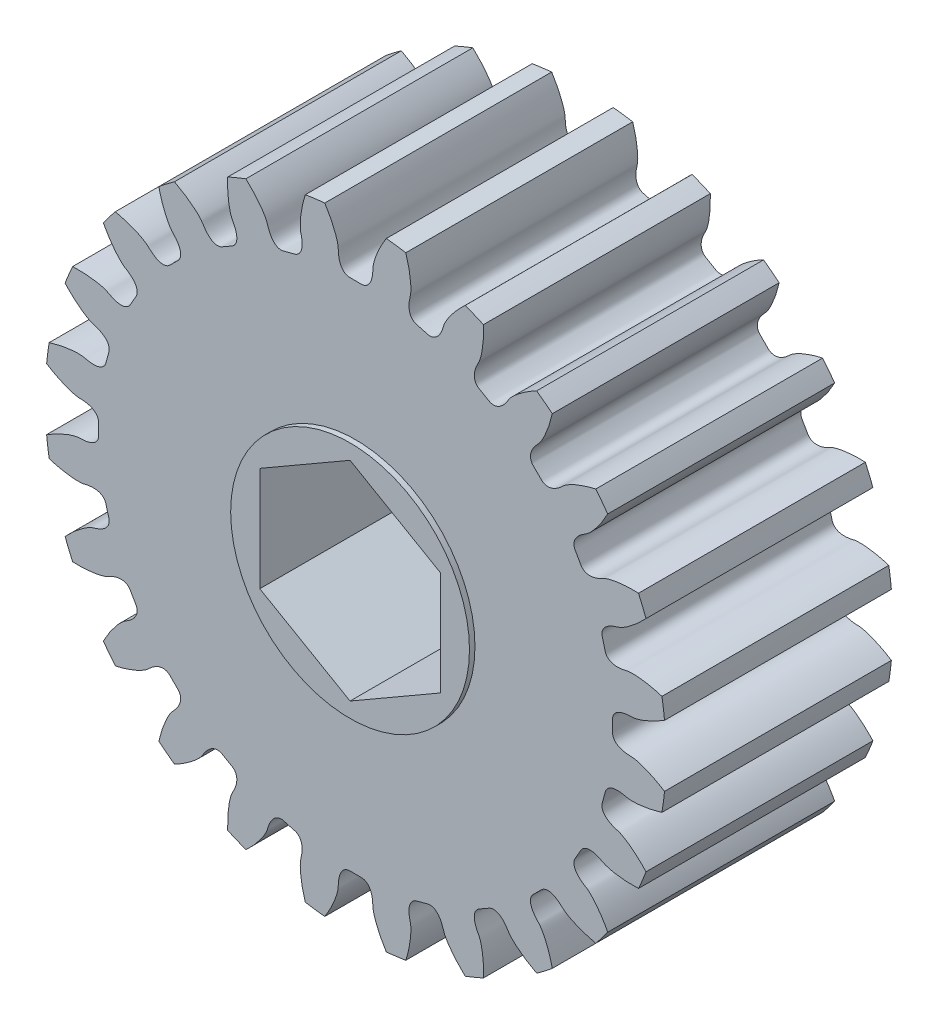
from build123d import *

# Parameters (mm, degrees)
BOSS_EXTRUDE1_DEPTH = 12.065
SKETCH2_R           = 6.35
BOSS_EXTRUDE2_DEPTH = 0.2921
BOSS_EXTRUDE3_START = 0.2921
SKETCH3_R           = 6.35
BOSS_EXTRUDE3_DEPTH = 0.2921
CUT_EXTRUDE1_DEPTH  = 27.454065155


with BuildPart() as part:
    # Sketch1 → Boss-Extrude1 (new body)
    with BuildSketch(Plane(origin=(0, 0, -6.0325), x_dir=(-1, 0, 0), z_dir=(0, 0, -1))):
        with BuildLine():
            ThreePointArc((-12.77291519, 10.46101035), (-13.098263648, 10.050651193), (-13.410433779, 9.63017995))
            add(Edge.make_bspline(
                [(-15.045197369, 6.798686353), (-14.873297535, 6.805692341), (-14.649953152, 6.807138862), (-14.379005178, 6.794510105), (-14.235225084, 6.784188863), (-14.101005346, 6.771164086), (-13.976385487, 6.755908447), (-13.861387028, 6.738895015), (-13.756013949, 6.720596407), (-13.660252351, 6.701483906), (-13.574071493, 6.682028095), (-13.497420793, 6.662694288), (-13.430239616, 6.643954511), (-13.372427489, 6.626248154), (-13.296250192, 6.600877851), (-13.225703417, 6.573215282), (-13.16301586, 6.535644254), (-13.124001527, 6.514542427), (-13.085607289, 6.494262854), (-13.047639719, 6.475150065), (-13.010145976, 6.457100342), (-12.973107641, 6.440126868), (-12.93651973, 6.424213293), (-12.900369691, 6.409352026), (-12.864642271, 6.395534665), (-12.829317572, 6.382754948), (-12.79437077, 6.371008597), (-12.759771278, 6.360294137), (-12.725481913, 6.350613693), (-12.691457924, 6.341974095), (-12.657645904, 6.334388296), (-12.623982608, 6.327877232), (-12.590393703, 6.322472245), (-12.556792554, 6.318218241), (-12.523079194, 6.315177808), (-12.489139755, 6.313436524), (-12.454846838, 6.31310974), (-12.420061569, 6.314351082), (-12.384638511, 6.317362748), (-12.348435163, 6.322407349), (-12.311328424, 6.329820213), (-12.273240984, 6.340019665), (-12.234180462, 6.353510435), (-12.194292679, 6.370872195), (-12.153924918, 6.392722008), (-12.113689118, 6.419639172), (-12.074489994, 6.452046706), (-12.037524498, 6.49006511), (-12.006182734, 6.530624969), (-11.93683776, 6.644251729), (-11.83852176, 6.834973725), (-11.722509667, 7.015478876), (-11.658778493, 7.132346765), (-11.639323506, 7.179769459), (-11.624881351, 7.23079172), (-11.616415165, 7.280942924), (-11.613222117, 7.329246731), (-11.614483505, 7.375131143), (-11.619391671, 7.418355857), (-11.627238582, 7.458928646), (-11.637449318, 7.497013063), (-11.649582958, 7.532854874), (-11.66331588, 7.566730194), (-11.67841923, 7.598913294), (-11.694736831, 7.629658891), (-11.712166292, 7.659194037), (-11.730644008, 7.687715812), (-11.75013378, 7.715392222), (-11.77061843, 7.742364668), (-11.792093739, 7.768751019), (-11.814564134, 7.794648757), (-11.838039638, 7.820137926), (-11.862533745, 7.845283766), (-11.888061937, 7.870139005), (-11.914640678, 7.894745814), (-11.942286717, 7.919137457), (-11.971016626, 7.943339685), (-12.000846522, 7.967371857), (-12.031791776, 7.991248076), (-12.063867292, 8.014977349), (-12.09708592, 8.038566751), (-12.131464309, 8.062012423), (-12.167000255, 8.085336909), (-12.203759999, 8.108447508), (-12.241541884, 8.131683998), (-12.305423127, 8.167187501), (-12.364653002, 8.214451516), (-12.424712977, 8.267737839), (-12.468953197, 8.308951431), (-12.518772908, 8.357762148), (-12.573841826, 8.414476699), (-12.633781481, 8.479383605), (-12.698214192, 8.552759331), (-12.76674779, 8.63486579), (-12.838981084, 8.725950661), (-12.914502784, 8.826246805), (-12.992892441, 8.93597212), (-13.073720946, 9.055328713), (-13.220131757, 9.283662163), (-13.330551225, 9.477807333), (-13.410433779, 9.63017995)],
                knots=[0, 0, 0, 0, 0.073028032, 0.094740238, 0.115136553, 0.134216977, 0.151981509, 0.168430151, 0.183562901, 0.197379759, 0.209880727, 0.221065803, 0.230934988, 0.239488282, 0.246725684, 0.265042197, 0.271452592, 0.277728243, 0.283871565, 0.289885249, 0.295772294, 0.301536056, 0.307180296, 0.312709247, 0.318127684, 0.323441008, 0.328655347, 0.333777681, 0.338815973, 0.343779346, 0.348678271, 0.353524805, 0.358332856, 0.363118494, 0.367900306, 0.372699782, 0.377541719, 0.382454611, 0.387470953, 0.392627347, 0.397964218, 0.403524864, 0.409353442, 0.415491449, 0.42197228, 0.428813857, 0.436010122, 0.443523453, 0.451281216, 0.457711951, 0.5, 0.542288049, 0.548718784, 0.556476547, 0.563989878, 0.571186143, 0.57802772, 0.584508551, 0.590646558, 0.596475136, 0.602035782, 0.607372653, 0.612529047, 0.617545389, 0.622458281, 0.627300218, 0.632099694, 0.636881506, 0.641667144, 0.646475195, 0.651321729, 0.656220654, 0.661184027, 0.666222319, 0.671344653, 0.676558992, 0.681872316, 0.687290753, 0.692819704, 0.698463944, 0.704227706, 0.710114751, 0.716128435, 0.722271757, 0.728547408, 0.734957803, 0.753274316, 0.760511718, 0.769065012, 0.778934197, 0.790119273, 0.802620241, 0.816437099, 0.831569849, 0.848018491, 0.865783023, 0.884863447, 0.905259762, 0.926971968, 1, 1, 1, 1], degree=3))
            ThreePointArc((-15.045197369, 6.798686353), (-15.253251082, 6.318103468), (-15.445958307, 5.83116386))
            add(Edge.make_bspline(
                [(-16.29217421, 2.673043117), (-16.127945004, 2.724301333), (-15.912585283, 2.783504344), (-15.647601075, 2.841432398), (-15.506048835, 2.86867587), (-15.373031463, 2.890833526), (-15.248709473, 2.908351703), (-15.133226091, 2.921681781), (-15.026707485, 2.931279243), (-14.929262205, 2.93760291), (-14.840982354, 2.941115287), (-14.761939506, 2.942278925), (-14.692197261, 2.941565458), (-14.631772292, 2.939425309), (-14.551624356, 2.934635614), (-14.476321804, 2.926174474), (-14.406046176, 2.906108381), (-14.362899669, 2.895823234), (-14.320564944, 2.88617183), (-14.278944333, 2.877537024), (-14.238056547, 2.869806425), (-14.197887204, 2.862997535), (-14.158427259, 2.85709585), (-14.119662624, 2.852097287), (-14.08157639, 2.847997677), (-14.044147717, 2.844796124), (-14.00735152, 2.842494918), (-13.97115787, 2.841100552), (-13.935531404, 2.840624702), (-13.900430661, 2.841085547), (-13.865807409, 2.842509423), (-13.831605974, 2.84493292), (-13.79776267, 2.848405551), (-13.764205435, 2.852993117), (-13.730853908, 2.858781944), (-13.69762025, 2.865884165), (-13.664411258, 2.874444177), (-13.631132551, 2.884646311), (-13.597695981, 2.896723519), (-13.564031871, 2.910966345), (-13.530108104, 2.927730553), (-13.495958274, 2.947440222), (-13.461720375, 2.970580912), (-13.42768529, 2.997674803), (-13.394348175, 3.029228046), (-13.362450051, 3.065641821), (-13.332974292, 3.107090575), (-13.307108251, 3.153380908), (-13.287332096, 3.200670569), (-13.249758765, 3.328373391), (-13.204155286, 3.538042746), (-13.13881438, 3.742423472), (-13.107502428, 3.871804026), (-13.100984251, 3.922646151), (-13.100239733, 3.975667776), (-13.105042112, 4.02630133), (-13.11445981, 4.073785646), (-13.127553976, 4.117780114), (-13.14348228, 4.158261654), (-13.161562825, 4.195421029), (-13.18128261, 4.229565018), (-13.20227935, 4.261045131), (-13.224311912, 4.290211836), (-13.247230227, 4.317389289), (-13.270949365, 4.34286395), (-13.29542919, 4.366881633), (-13.320659272, 4.389649167), (-13.346648128, 4.411338202), (-13.373415763, 4.432089767), (-13.400988609, 4.452018806), (-13.429396172, 4.471218334), (-13.45866885, 4.489763072), (-13.488836562, 4.507712547), (-13.519927912, 4.525113682), (-13.551969715, 4.542002951), (-13.584986759, 4.558408147), (-13.619001718, 4.574349856), (-13.654035169, 4.589842607), (-13.690105609, 4.604896043), (-13.727229766, 4.619515006), (-13.765421883, 4.633703005), (-13.804697044, 4.647452003), (-13.845058953, 4.660784347), (-13.886547602, 4.673593349), (-13.929056147, 4.686259404), (-13.999949672, 4.704019472), (-14.069394166, 4.734343185), (-14.141199162, 4.770269155), (-14.194598794, 4.798628217), (-14.255354084, 4.832881459), (-14.323225379, 4.873410623), (-14.397921784, 4.920592356), (-14.479150039, 4.974791453), (-14.566599127, 5.036362401), (-14.65994563, 5.105648278), (-14.758852543, 5.18298046), (-14.862970138, 5.268678239), (-14.971936238, 5.363047898), (-15.172455267, 5.545707168), (-15.329360751, 5.70465834), (-15.445958307, 5.83116386)],
                knots=[0, 0, 0, 0, 0.073028032, 0.094740238, 0.115136553, 0.134216977, 0.151981509, 0.168430151, 0.183562901, 0.197379759, 0.209880727, 0.221065803, 0.230934988, 0.239488282, 0.246725684, 0.265042197, 0.271452592, 0.277728243, 0.283871565, 0.289885249, 0.295772294, 0.301536056, 0.307180296, 0.312709247, 0.318127684, 0.323441008, 0.328655347, 0.333777681, 0.338815973, 0.343779346, 0.348678271, 0.353524805, 0.358332856, 0.363118494, 0.367900306, 0.372699782, 0.377541719, 0.382454611, 0.387470953, 0.392627347, 0.397964218, 0.403524864, 0.409353442, 0.415491449, 0.42197228, 0.428813857, 0.436010122, 0.443523453, 0.451281216, 0.457711951, 0.5, 0.542288049, 0.548718784, 0.556476547, 0.563989878, 0.571186143, 0.57802772, 0.584508551, 0.590646558, 0.596475136, 0.602035782, 0.607372653, 0.612529047, 0.617545389, 0.622458281, 0.627300218, 0.632099694, 0.636881506, 0.641667144, 0.646475195, 0.651321729, 0.656220654, 0.661184027, 0.666222319, 0.671344653, 0.676558992, 0.681872316, 0.687290753, 0.692819704, 0.698463944, 0.704227706, 0.710114751, 0.716128435, 0.722271757, 0.728547408, 0.734957803, 0.753274316, 0.760511718, 0.769065012, 0.778934197, 0.790119273, 0.802620241, 0.816437099, 0.831569849, 0.848018491, 0.865783023, 0.884863447, 0.905259762, 0.926971968, 1, 1, 1, 1], degree=3))
            ThreePointArc((-16.29217421, 2.673043117), (-16.368754661, 2.154987434), (-16.428866303, 1.63476359))
            add(Edge.make_bspline(
                [(-16.428866303, -1.63476359), (-16.283499674, -1.54274631), (-16.090801024, -1.429821394), (-15.849838818, -1.305284232), (-15.720160982, -1.242332643), (-15.597410891, -1.186502561), (-15.481859108, -1.137404403), (-15.373760805, -1.094639238), (-15.273355738, -1.057799757), (-15.180867511, -1.02647087), (-15.096504793, -1.000229668), (-15.020456437, -0.978647885), (-14.952905942, -0.96128642), (-14.893985993, -0.947714512), (-14.815329367, -0.93159719), (-14.740402783, -0.92028029), (-14.667328252, -0.921473976), (-14.622989935, -0.920241527), (-14.579599763, -0.918607034), (-14.537162488, -0.916175409), (-14.495667094, -0.913060057), (-14.455104217, -0.909240349), (-14.415461369, -0.904727954), (-14.376723884, -0.899523169), (-14.338874349, -0.893625645), (-14.301892404, -0.887030855), (-14.265754411, -0.879730093), (-14.230433142, -0.871709341), (-14.195897459, -0.862948168), (-14.162112021, -0.853418286), (-14.129037053, -0.84308177), (-14.096628251, -0.831888869), (-14.064836913, -0.819775273), (-14.033610463, -0.806658774), (-14.00289362, -0.792435186), (-13.972630561, -0.776973463), (-13.942768632, -0.760110007), (-13.913264376, -0.741642339), (-13.884092941, -0.721322631), (-13.855262222, -0.698852205), (-13.826833276, -0.673879106), (-13.798948311, -0.646002402), (-13.771866292, -0.614788791), (-13.746003338, -0.579809174), (-13.721968739, -0.540702801), (-13.700582096, -0.497273953), (-13.682838426, -0.449608643), (-13.669834569, -0.398200991), (-13.662971734, -0.347404241), (-13.659730606, -0.214328093), (-13.66994745, 0), (-13.659730606, 0.214328093), (-13.662971734, 0.347404241), (-13.669834569, 0.398200991), (-13.682838426, 0.449608643), (-13.700582096, 0.497273953), (-13.721968739, 0.540702801), (-13.746003338, 0.579809174), (-13.771866292, 0.614788791), (-13.798948311, 0.646002402), (-13.826833276, 0.673879106), (-13.855262222, 0.698852205), (-13.884092941, 0.721322631), (-13.913264376, 0.741642339), (-13.942768632, 0.760110007), (-13.972630561, 0.776973463), (-14.00289362, 0.792435186), (-14.033610463, 0.806658774), (-14.064836913, 0.819775273), (-14.096628251, 0.831888869), (-14.129037053, 0.84308177), (-14.162112021, 0.853418286), (-14.195897459, 0.862948168), (-14.230433142, 0.871709341), (-14.265754411, 0.879730093), (-14.301892404, 0.887030855), (-14.338874349, 0.893625645), (-14.376723884, 0.899523169), (-14.415461369, 0.904727954), (-14.455104217, 0.909240349), (-14.495667094, 0.913060057), (-14.537162488, 0.916175409), (-14.579599763, 0.918607034), (-14.622989935, 0.920241527), (-14.667328252, 0.921473976), (-14.740402783, 0.92028029), (-14.815329367, 0.93159719), (-14.893985993, 0.947714512), (-14.952905942, 0.96128642), (-15.020456437, 0.978647885), (-15.096504793, 1.000229668), (-15.180867511, 1.02647087), (-15.273355738, 1.057799757), (-15.373760805, 1.094639238), (-15.481859108, 1.137404403), (-15.597410891, 1.186502561), (-15.720160982, 1.242332643), (-15.849838818, 1.305284232), (-16.090801024, 1.429821394), (-16.283499674, 1.54274631), (-16.428866303, 1.63476359)],
                knots=[0, 0, 0, 0, 0.073028032, 0.094740238, 0.115136553, 0.134216977, 0.151981509, 0.168430151, 0.183562901, 0.197379759, 0.209880727, 0.221065803, 0.230934988, 0.239488282, 0.246725684, 0.265042197, 0.271452592, 0.277728243, 0.283871565, 0.289885249, 0.295772294, 0.301536056, 0.307180296, 0.312709247, 0.318127684, 0.323441008, 0.328655347, 0.333777681, 0.338815973, 0.343779346, 0.348678271, 0.353524805, 0.358332856, 0.363118494, 0.367900306, 0.372699782, 0.377541719, 0.382454611, 0.387470953, 0.392627347, 0.397964218, 0.403524864, 0.409353442, 0.415491449, 0.42197228, 0.428813857, 0.436010122, 0.443523453, 0.451281216, 0.457711951, 0.5, 0.542288049, 0.548718784, 0.556476547, 0.563989878, 0.571186143, 0.57802772, 0.584508551, 0.590646558, 0.596475136, 0.602035782, 0.607372653, 0.612529047, 0.617545389, 0.622458281, 0.627300218, 0.632099694, 0.636881506, 0.641667144, 0.646475195, 0.651321729, 0.656220654, 0.661184027, 0.666222319, 0.671344653, 0.676558992, 0.681872316, 0.687290753, 0.692819704, 0.698463944, 0.704227706, 0.710114751, 0.716128435, 0.722271757, 0.728547408, 0.734957803, 0.753274316, 0.760511718, 0.769065012, 0.778934197, 0.790119273, 0.802620241, 0.816437099, 0.831569849, 0.848018491, 0.865783023, 0.884863447, 0.905259762, 0.926971968, 1, 1, 1, 1], degree=3))
            ThreePointArc((-16.428866303, -1.63476359), (-16.368754661, -2.154987434), (-16.29217421, -2.673043117))
            add(Edge.make_bspline(
                [(-15.445958307, -5.83116386), (-15.329360751, -5.70465834), (-15.172455267, -5.545707168), (-14.971936238, -5.363047898), (-14.862970138, -5.268678239), (-14.758852543, -5.18298046), (-14.65994563, -5.105648278), (-14.566599127, -5.036362401), (-14.479150039, -4.974791453), (-14.397921784, -4.920592356), (-14.323225379, -4.873410623), (-14.255354084, -4.832881459), (-14.194598794, -4.798628217), (-14.141199162, -4.770269155), (-14.069394166, -4.734343185), (-13.999949672, -4.704019472), (-13.929056147, -4.686259404), (-13.886547602, -4.673593349), (-13.845058953, -4.660784347), (-13.804697044, -4.647452003), (-13.765421883, -4.633703005), (-13.727229766, -4.619515006), (-13.690105609, -4.604896043), (-13.654035169, -4.589842607), (-13.619001718, -4.574349856), (-13.584986759, -4.558408147), (-13.551969715, -4.542002951), (-13.519927912, -4.525113682), (-13.488836562, -4.507712547), (-13.45866885, -4.489763072), (-13.429396172, -4.471218334), (-13.400988609, -4.452018806), (-13.373415763, -4.432089767), (-13.346648128, -4.411338202), (-13.320659272, -4.389649167), (-13.29542919, -4.366881633), (-13.270949365, -4.34286395), (-13.247230227, -4.317389289), (-13.224311912, -4.290211836), (-13.20227935, -4.261045131), (-13.18128261, -4.229565018), (-13.161562825, -4.195421029), (-13.14348228, -4.158261654), (-13.127553976, -4.117780114), (-13.11445981, -4.073785646), (-13.105042112, -4.02630133), (-13.100239733, -3.975667776), (-13.100984251, -3.922646151), (-13.107502428, -3.871804026), (-13.13881438, -3.742423472), (-13.204155286, -3.538042746), (-13.249758765, -3.328373391), (-13.287332096, -3.200670569), (-13.307108251, -3.153380908), (-13.332974292, -3.107090575), (-13.362450051, -3.065641821), (-13.394348175, -3.029228046), (-13.42768529, -2.997674803), (-13.461720375, -2.970580912), (-13.495958274, -2.947440222), (-13.530108104, -2.927730553), (-13.564031871, -2.910966345), (-13.597695981, -2.896723519), (-13.631132551, -2.884646311), (-13.664411258, -2.874444177), (-13.69762025, -2.865884165), (-13.730853908, -2.858781944), (-13.764205435, -2.852993117), (-13.79776267, -2.848405551), (-13.831605974, -2.84493292), (-13.865807409, -2.842509423), (-13.900430661, -2.841085547), (-13.935531404, -2.840624702), (-13.97115787, -2.841100552), (-14.00735152, -2.842494918), (-14.044147717, -2.844796124), (-14.08157639, -2.847997677), (-14.119662624, -2.852097287), (-14.158427259, -2.85709585), (-14.197887204, -2.862997535), (-14.238056547, -2.869806425), (-14.278944333, -2.877537024), (-14.320564944, -2.88617183), (-14.362899669, -2.895823234), (-14.406046176, -2.906108381), (-14.476321804, -2.926174474), (-14.551624356, -2.934635614), (-14.631772292, -2.939425309), (-14.692197261, -2.941565458), (-14.761939506, -2.942278925), (-14.840982354, -2.941115287), (-14.929262205, -2.93760291), (-15.026707485, -2.931279243), (-15.133226091, -2.921681781), (-15.248709473, -2.908351703), (-15.373031463, -2.890833526), (-15.506048835, -2.86867587), (-15.647601075, -2.841432398), (-15.912585283, -2.783504344), (-16.127945004, -2.724301333), (-16.29217421, -2.673043117)],
                knots=[0, 0, 0, 0, 0.073028032, 0.094740238, 0.115136553, 0.134216977, 0.151981509, 0.168430151, 0.183562901, 0.197379759, 0.209880727, 0.221065803, 0.230934988, 0.239488282, 0.246725684, 0.265042197, 0.271452592, 0.277728243, 0.283871565, 0.289885249, 0.295772294, 0.301536056, 0.307180296, 0.312709247, 0.318127684, 0.323441008, 0.328655347, 0.333777681, 0.338815973, 0.343779346, 0.348678271, 0.353524805, 0.358332856, 0.363118494, 0.367900306, 0.372699782, 0.377541719, 0.382454611, 0.387470953, 0.392627347, 0.397964218, 0.403524864, 0.409353442, 0.415491449, 0.42197228, 0.428813857, 0.436010122, 0.443523453, 0.451281216, 0.457711951, 0.5, 0.542288049, 0.548718784, 0.556476547, 0.563989878, 0.571186143, 0.57802772, 0.584508551, 0.590646558, 0.596475136, 0.602035782, 0.607372653, 0.612529047, 0.617545389, 0.622458281, 0.627300218, 0.632099694, 0.636881506, 0.641667144, 0.646475195, 0.651321729, 0.656220654, 0.661184027, 0.666222319, 0.671344653, 0.676558992, 0.681872316, 0.687290753, 0.692819704, 0.698463944, 0.704227706, 0.710114751, 0.716128435, 0.722271757, 0.728547408, 0.734957803, 0.753274316, 0.760511718, 0.769065012, 0.778934197, 0.790119273, 0.802620241, 0.816437099, 0.831569849, 0.848018491, 0.865783023, 0.884863447, 0.905259762, 0.926971968, 1, 1, 1, 1], degree=3))
            ThreePointArc((-15.445958307, -5.83116386), (-15.253251082, -6.318103468), (-15.045197369, -6.798686353))
            add(Edge.make_bspline(
                [(-13.410433779, -9.63017995), (-13.330551225, -9.477807333), (-13.220131757, -9.283662163), (-13.073720946, -9.055328713), (-12.992892441, -8.93597212), (-12.914502784, -8.826246805), (-12.838981084, -8.725950661), (-12.76674779, -8.63486579), (-12.698214192, -8.552759331), (-12.633781481, -8.479383605), (-12.573841826, -8.414476699), (-12.518772908, -8.357762148), (-12.468953197, -8.308951431), (-12.424712977, -8.267737839), (-12.364653002, -8.214451516), (-12.305423127, -8.167187501), (-12.241541884, -8.131683998), (-12.203759999, -8.108447508), (-12.167000255, -8.085336909), (-12.131464309, -8.062012423), (-12.09708592, -8.038566751), (-12.063867292, -8.014977349), (-12.031791776, -7.991248076), (-12.000846522, -7.967371857), (-11.971016626, -7.943339685), (-11.942286717, -7.919137457), (-11.914640678, -7.894745814), (-11.888061937, -7.870139005), (-11.862533745, -7.845283766), (-11.838039638, -7.820137926), (-11.814564134, -7.794648757), (-11.792093739, -7.768751019), (-11.77061843, -7.742364668), (-11.75013378, -7.715392222), (-11.730644008, -7.687715812), (-11.712166292, -7.659194037), (-11.694736831, -7.629658891), (-11.67841923, -7.598913294), (-11.66331588, -7.566730194), (-11.649582958, -7.532854874), (-11.637449318, -7.497013063), (-11.627238582, -7.458928646), (-11.619391671, -7.418355857), (-11.614483505, -7.375131143), (-11.613222117, -7.329246731), (-11.616415165, -7.280942924), (-11.624881351, -7.23079172), (-11.639323506, -7.179769459), (-11.658778493, -7.132346765), (-11.722509667, -7.015478876), (-11.83852176, -6.834973725), (-11.93683776, -6.644251729), (-12.006182734, -6.530624969), (-12.037524498, -6.49006511), (-12.074489994, -6.452046706), (-12.113689118, -6.419639172), (-12.153924918, -6.392722008), (-12.194292679, -6.370872195), (-12.234180462, -6.353510435), (-12.273240984, -6.340019665), (-12.311328424, -6.329820213), (-12.348435163, -6.322407349), (-12.384638511, -6.317362748), (-12.420061569, -6.314351082), (-12.454846838, -6.31310974), (-12.489139755, -6.313436524), (-12.523079194, -6.315177808), (-12.556792554, -6.318218241), (-12.590393703, -6.322472245), (-12.623982608, -6.327877232), (-12.657645904, -6.334388296), (-12.691457924, -6.341974095), (-12.725481913, -6.350613693), (-12.759771278, -6.360294137), (-12.79437077, -6.371008597), (-12.829317572, -6.382754948), (-12.864642271, -6.395534665), (-12.900369691, -6.409352026), (-12.93651973, -6.424213293), (-12.973107641, -6.440126868), (-13.010145976, -6.457100342), (-13.047639719, -6.475150065), (-13.085607289, -6.494262854), (-13.124001527, -6.514542427), (-13.16301586, -6.535644254), (-13.225703417, -6.573215282), (-13.296250192, -6.600877851), (-13.372427489, -6.626248154), (-13.430239616, -6.643954511), (-13.497420793, -6.662694288), (-13.574071493, -6.682028095), (-13.660252351, -6.701483906), (-13.756013949, -6.720596407), (-13.861387028, -6.738895015), (-13.976385487, -6.755908447), (-14.101005346, -6.771164086), (-14.235225084, -6.784188863), (-14.379005178, -6.794510105), (-14.649953152, -6.807138862), (-14.873297535, -6.805692341), (-15.045197369, -6.798686353)],
                knots=[0, 0, 0, 0, 0.073028032, 0.094740238, 0.115136553, 0.134216977, 0.151981509, 0.168430151, 0.183562901, 0.197379759, 0.209880727, 0.221065803, 0.230934988, 0.239488282, 0.246725684, 0.265042197, 0.271452592, 0.277728243, 0.283871565, 0.289885249, 0.295772294, 0.301536056, 0.307180296, 0.312709247, 0.318127684, 0.323441008, 0.328655347, 0.333777681, 0.338815973, 0.343779346, 0.348678271, 0.353524805, 0.358332856, 0.363118494, 0.367900306, 0.372699782, 0.377541719, 0.382454611, 0.387470953, 0.392627347, 0.397964218, 0.403524864, 0.409353442, 0.415491449, 0.42197228, 0.428813857, 0.436010122, 0.443523453, 0.451281216, 0.457711951, 0.5, 0.542288049, 0.548718784, 0.556476547, 0.563989878, 0.571186143, 0.57802772, 0.584508551, 0.590646558, 0.596475136, 0.602035782, 0.607372653, 0.612529047, 0.617545389, 0.622458281, 0.627300218, 0.632099694, 0.636881506, 0.641667144, 0.646475195, 0.651321729, 0.656220654, 0.661184027, 0.666222319, 0.671344653, 0.676558992, 0.681872316, 0.687290753, 0.692819704, 0.698463944, 0.704227706, 0.710114751, 0.716128435, 0.722271757, 0.728547408, 0.734957803, 0.753274316, 0.760511718, 0.769065012, 0.778934197, 0.790119273, 0.802620241, 0.816437099, 0.831569849, 0.848018491, 0.865783023, 0.884863447, 0.905259762, 0.926971968, 1, 1, 1, 1], degree=3))
            ThreePointArc((-13.410433779, -9.63017995), (-13.098263648, -10.050651193), (-12.77291519, -10.46101035))
            add(Edge.make_bspline(
                [(-10.46101035, -12.77291519), (-10.423286664, -12.605059418), (-10.366878115, -12.388950923), (-10.284553177, -12.130503841), (-10.237370596, -11.994294268), (-10.190051003, -11.868019017), (-10.143061194, -11.751593927), (-10.09686369, -11.644917346), (-10.051916032, -11.547870796), (-10.008669849, -11.460318874), (-9.967571731, -11.382110092), (-9.929058047, -11.313075159), (-9.893569044, -11.253033336), (-9.861503136, -11.201773852), (-9.817281171, -11.134758552), (-9.772302332, -11.073775199), (-9.719786772, -11.022947766), (-9.68930632, -10.990724369), (-9.659780596, -10.958887123), (-9.63149233, -10.92716002), (-9.604353542, -10.895615458), (-9.578372198, -10.864232231), (-9.553531217, -10.833009759), (-9.529820017, -10.801937882), (-9.507226533, -10.77100404), (-9.48573957, -10.740190636), (-9.465348569, -10.709474797), (-9.446044188, -10.67882736), (-9.427818856, -10.64821186), (-9.410667589, -10.617583303), (-9.394589075, -10.586886749), (-9.379587168, -10.556055689), (-9.365672903, -10.525010212), (-9.352867233, -10.493655012), (-9.341204741, -10.461877328), (-9.330738616, -10.429545025), (-9.321547308, -10.396505188), (-9.313743262, -10.362583916), (-9.307484146, -10.327588394), (-9.30298674, -10.291313005), (-9.300543086, -10.253552058), (-9.300537245, -10.214122603), (-9.303458722, -10.172901368), (-9.309905176, -10.129879174), (-9.320562529, -10.085231764), (-9.336148722, -10.039400291), (-9.357306516, -9.993149157), (-9.3844621, -9.947603342), (-9.41552807, -9.906831859), (-9.507335292, -9.810440989), (-9.666112541, -9.666112541), (-9.810440989, -9.507335292), (-9.906831859, -9.41552807), (-9.947603342, -9.3844621), (-9.993149157, -9.357306516), (-10.039400291, -9.336148722), (-10.085231764, -9.320562529), (-10.129879174, -9.309905176), (-10.172901368, -9.303458722), (-10.214122603, -9.300537245), (-10.253552058, -9.300543086), (-10.291313005, -9.30298674), (-10.327588394, -9.307484146), (-10.362583916, -9.313743262), (-10.396505188, -9.321547308), (-10.429545025, -9.330738616), (-10.461877328, -9.341204741), (-10.493655012, -9.352867233), (-10.525010212, -9.365672903), (-10.556055689, -9.379587168), (-10.586886749, -9.394589075), (-10.617583303, -9.410667589), (-10.64821186, -9.427818856), (-10.67882736, -9.446044188), (-10.709474797, -9.465348569), (-10.740190636, -9.48573957), (-10.77100404, -9.507226533), (-10.801937882, -9.529820017), (-10.833009759, -9.553531217), (-10.864232231, -9.578372198), (-10.895615458, -9.604353542), (-10.92716002, -9.63149233), (-10.958887123, -9.659780596), (-10.990724369, -9.68930632), (-11.022947766, -9.719786772), (-11.073775199, -9.772302332), (-11.134758552, -9.817281171), (-11.201773852, -9.861503136), (-11.253033336, -9.893569044), (-11.313075159, -9.929058047), (-11.382110092, -9.967571731), (-11.460318874, -10.008669849), (-11.547870796, -10.051916032), (-11.644917346, -10.09686369), (-11.751593927, -10.143061194), (-11.868019017, -10.190051003), (-11.994294268, -10.237370596), (-12.130503841, -10.284553177), (-12.388950923, -10.366878115), (-12.605059418, -10.423286664), (-12.77291519, -10.46101035)],
                knots=[0, 0, 0, 0, 0.073028032, 0.094740238, 0.115136553, 0.134216977, 0.151981509, 0.168430151, 0.183562901, 0.197379759, 0.209880727, 0.221065803, 0.230934988, 0.239488282, 0.246725684, 0.265042197, 0.271452592, 0.277728243, 0.283871565, 0.289885249, 0.295772294, 0.301536056, 0.307180296, 0.312709247, 0.318127684, 0.323441008, 0.328655347, 0.333777681, 0.338815973, 0.343779346, 0.348678271, 0.353524805, 0.358332856, 0.363118494, 0.367900306, 0.372699782, 0.377541719, 0.382454611, 0.387470953, 0.392627347, 0.397964218, 0.403524864, 0.409353442, 0.415491449, 0.42197228, 0.428813857, 0.436010122, 0.443523453, 0.451281216, 0.457711951, 0.5, 0.542288049, 0.548718784, 0.556476547, 0.563989878, 0.571186143, 0.57802772, 0.584508551, 0.590646558, 0.596475136, 0.602035782, 0.607372653, 0.612529047, 0.617545389, 0.622458281, 0.627300218, 0.632099694, 0.636881506, 0.641667144, 0.646475195, 0.651321729, 0.656220654, 0.661184027, 0.666222319, 0.671344653, 0.676558992, 0.681872316, 0.687290753, 0.692819704, 0.698463944, 0.704227706, 0.710114751, 0.716128435, 0.722271757, 0.728547408, 0.734957803, 0.753274316, 0.760511718, 0.769065012, 0.778934197, 0.790119273, 0.802620241, 0.816437099, 0.831569849, 0.848018491, 0.865783023, 0.884863447, 0.905259762, 0.926971968, 1, 1, 1, 1], degree=3))
            ThreePointArc((-10.46101035, -12.77291519), (-10.050651193, -13.098263648), (-9.63017995, -13.410433779))
            add(Edge.make_bspline(
                [(-6.798686353, -15.045197369), (-6.805692341, -14.873297535), (-6.807138862, -14.649953152), (-6.794510105, -14.379005178), (-6.784188863, -14.235225084), (-6.771164086, -14.101005346), (-6.755908447, -13.976385487), (-6.738895015, -13.861387028), (-6.720596407, -13.756013949), (-6.701483906, -13.660252351), (-6.682028095, -13.574071493), (-6.662694288, -13.497420793), (-6.643954511, -13.430239616), (-6.626248154, -13.372427489), (-6.600877851, -13.296250192), (-6.573215282, -13.225703417), (-6.535644254, -13.16301586), (-6.514542427, -13.124001527), (-6.494262854, -13.085607289), (-6.475150065, -13.047639719), (-6.457100342, -13.010145976), (-6.440126868, -12.973107641), (-6.424213293, -12.93651973), (-6.409352026, -12.900369691), (-6.395534665, -12.864642271), (-6.382754948, -12.829317572), (-6.371008597, -12.79437077), (-6.360294137, -12.759771278), (-6.350613693, -12.725481913), (-6.341974095, -12.691457924), (-6.334388296, -12.657645904), (-6.327877232, -12.623982608), (-6.322472245, -12.590393703), (-6.318218241, -12.556792554), (-6.315177808, -12.523079194), (-6.313436524, -12.489139755), (-6.31310974, -12.454846838), (-6.314351082, -12.420061569), (-6.317362748, -12.384638511), (-6.322407349, -12.348435163), (-6.329820213, -12.311328424), (-6.340019665, -12.273240984), (-6.353510435, -12.234180462), (-6.370872195, -12.194292679), (-6.392722008, -12.153924918), (-6.419639172, -12.113689118), (-6.452046706, -12.074489994), (-6.49006511, -12.037524498), (-6.530624969, -12.006182734), (-6.644251729, -11.93683776), (-6.834973725, -11.83852176), (-7.015478876, -11.722509667), (-7.132346765, -11.658778493), (-7.179769459, -11.639323506), (-7.23079172, -11.624881351), (-7.280942924, -11.616415165), (-7.329246731, -11.613222117), (-7.375131143, -11.614483505), (-7.418355857, -11.619391671), (-7.458928646, -11.627238582), (-7.497013063, -11.637449318), (-7.532854874, -11.649582958), (-7.566730194, -11.66331588), (-7.598913294, -11.67841923), (-7.629658891, -11.694736831), (-7.659194037, -11.712166292), (-7.687715812, -11.730644008), (-7.715392222, -11.75013378), (-7.742364668, -11.77061843), (-7.768751019, -11.792093739), (-7.794648757, -11.814564134), (-7.820137926, -11.838039638), (-7.845283766, -11.862533745), (-7.870139005, -11.888061937), (-7.894745814, -11.914640678), (-7.919137457, -11.942286717), (-7.943339685, -11.971016626), (-7.967371857, -12.000846522), (-7.991248076, -12.031791776), (-8.014977349, -12.063867292), (-8.038566751, -12.09708592), (-8.062012423, -12.131464309), (-8.085336909, -12.167000255), (-8.108447508, -12.203759999), (-8.131683998, -12.241541884), (-8.167187501, -12.305423127), (-8.214451516, -12.364653002), (-8.267737839, -12.424712977), (-8.308951431, -12.468953197), (-8.357762148, -12.518772908), (-8.414476699, -12.573841826), (-8.479383605, -12.633781481), (-8.552759331, -12.698214192), (-8.63486579, -12.76674779), (-8.725950661, -12.838981084), (-8.826246805, -12.914502784), (-8.93597212, -12.992892441), (-9.055328713, -13.073720946), (-9.283662163, -13.220131757), (-9.477807333, -13.330551225), (-9.63017995, -13.410433779)],
                knots=[0, 0, 0, 0, 0.073028032, 0.094740238, 0.115136553, 0.134216977, 0.151981509, 0.168430151, 0.183562901, 0.197379759, 0.209880727, 0.221065803, 0.230934988, 0.239488282, 0.246725684, 0.265042197, 0.271452592, 0.277728243, 0.283871565, 0.289885249, 0.295772294, 0.301536056, 0.307180296, 0.312709247, 0.318127684, 0.323441008, 0.328655347, 0.333777681, 0.338815973, 0.343779346, 0.348678271, 0.353524805, 0.358332856, 0.363118494, 0.367900306, 0.372699782, 0.377541719, 0.382454611, 0.387470953, 0.392627347, 0.397964218, 0.403524864, 0.409353442, 0.415491449, 0.42197228, 0.428813857, 0.436010122, 0.443523453, 0.451281216, 0.457711951, 0.5, 0.542288049, 0.548718784, 0.556476547, 0.563989878, 0.571186143, 0.57802772, 0.584508551, 0.590646558, 0.596475136, 0.602035782, 0.607372653, 0.612529047, 0.617545389, 0.622458281, 0.627300218, 0.632099694, 0.636881506, 0.641667144, 0.646475195, 0.651321729, 0.656220654, 0.661184027, 0.666222319, 0.671344653, 0.676558992, 0.681872316, 0.687290753, 0.692819704, 0.698463944, 0.704227706, 0.710114751, 0.716128435, 0.722271757, 0.728547408, 0.734957803, 0.753274316, 0.760511718, 0.769065012, 0.778934197, 0.790119273, 0.802620241, 0.816437099, 0.831569849, 0.848018491, 0.865783023, 0.884863447, 0.905259762, 0.926971968, 1, 1, 1, 1], degree=3))
            ThreePointArc((-6.798686353, -15.045197369), (-6.318103468, -15.253251082), (-5.83116386, -15.445958307))
            add(Edge.make_bspline(
                [(-2.673043117, -16.29217421), (-2.724301333, -16.127945004), (-2.783504344, -15.912585283), (-2.841432398, -15.647601075), (-2.86867587, -15.506048835), (-2.890833526, -15.373031463), (-2.908351703, -15.248709473), (-2.921681781, -15.133226091), (-2.931279243, -15.026707485), (-2.93760291, -14.929262205), (-2.941115287, -14.840982354), (-2.942278925, -14.761939506), (-2.941565458, -14.692197261), (-2.939425309, -14.631772292), (-2.934635614, -14.551624356), (-2.926174474, -14.476321804), (-2.906108381, -14.406046176), (-2.895823234, -14.362899669), (-2.88617183, -14.320564944), (-2.877537024, -14.278944333), (-2.869806425, -14.238056547), (-2.862997535, -14.197887204), (-2.85709585, -14.158427259), (-2.852097287, -14.119662624), (-2.847997677, -14.08157639), (-2.844796124, -14.044147717), (-2.842494918, -14.00735152), (-2.841100552, -13.97115787), (-2.840624702, -13.935531404), (-2.841085547, -13.900430661), (-2.842509423, -13.865807409), (-2.84493292, -13.831605974), (-2.848405551, -13.79776267), (-2.852993117, -13.764205435), (-2.858781944, -13.730853908), (-2.865884165, -13.69762025), (-2.874444177, -13.664411258), (-2.884646311, -13.631132551), (-2.896723519, -13.597695981), (-2.910966345, -13.564031871), (-2.927730553, -13.530108104), (-2.947440222, -13.495958274), (-2.970580912, -13.461720375), (-2.997674803, -13.42768529), (-3.029228046, -13.394348175), (-3.065641821, -13.362450051), (-3.107090575, -13.332974292), (-3.153380908, -13.307108251), (-3.200670569, -13.287332096), (-3.328373391, -13.249758765), (-3.538042746, -13.204155286), (-3.742423472, -13.13881438), (-3.871804026, -13.107502428), (-3.922646151, -13.100984251), (-3.975667776, -13.100239733), (-4.02630133, -13.105042112), (-4.073785646, -13.11445981), (-4.117780114, -13.127553976), (-4.158261654, -13.14348228), (-4.195421029, -13.161562825), (-4.229565018, -13.18128261), (-4.261045131, -13.20227935), (-4.290211836, -13.224311912), (-4.317389289, -13.247230227), (-4.34286395, -13.270949365), (-4.366881633, -13.29542919), (-4.389649167, -13.320659272), (-4.411338202, -13.346648128), (-4.432089767, -13.373415763), (-4.452018806, -13.400988609), (-4.471218334, -13.429396172), (-4.489763072, -13.45866885), (-4.507712547, -13.488836562), (-4.525113682, -13.519927912), (-4.542002951, -13.551969715), (-4.558408147, -13.584986759), (-4.574349856, -13.619001718), (-4.589842607, -13.654035169), (-4.604896043, -13.690105609), (-4.619515006, -13.727229766), (-4.633703005, -13.765421883), (-4.647452003, -13.804697044), (-4.660784347, -13.845058953), (-4.673593349, -13.886547602), (-4.686259404, -13.929056147), (-4.704019472, -13.999949672), (-4.734343185, -14.069394166), (-4.770269155, -14.141199162), (-4.798628217, -14.194598794), (-4.832881459, -14.255354084), (-4.873410623, -14.323225379), (-4.920592356, -14.397921784), (-4.974791453, -14.479150039), (-5.036362401, -14.566599127), (-5.105648278, -14.65994563), (-5.18298046, -14.758852543), (-5.268678239, -14.862970138), (-5.363047898, -14.971936238), (-5.545707168, -15.172455267), (-5.70465834, -15.329360751), (-5.83116386, -15.445958307)],
                knots=[0, 0, 0, 0, 0.073028032, 0.094740238, 0.115136553, 0.134216977, 0.151981509, 0.168430151, 0.183562901, 0.197379759, 0.209880727, 0.221065803, 0.230934988, 0.239488282, 0.246725684, 0.265042197, 0.271452592, 0.277728243, 0.283871565, 0.289885249, 0.295772294, 0.301536056, 0.307180296, 0.312709247, 0.318127684, 0.323441008, 0.328655347, 0.333777681, 0.338815973, 0.343779346, 0.348678271, 0.353524805, 0.358332856, 0.363118494, 0.367900306, 0.372699782, 0.377541719, 0.382454611, 0.387470953, 0.392627347, 0.397964218, 0.403524864, 0.409353442, 0.415491449, 0.42197228, 0.428813857, 0.436010122, 0.443523453, 0.451281216, 0.457711951, 0.5, 0.542288049, 0.548718784, 0.556476547, 0.563989878, 0.571186143, 0.57802772, 0.584508551, 0.590646558, 0.596475136, 0.602035782, 0.607372653, 0.612529047, 0.617545389, 0.622458281, 0.627300218, 0.632099694, 0.636881506, 0.641667144, 0.646475195, 0.651321729, 0.656220654, 0.661184027, 0.666222319, 0.671344653, 0.676558992, 0.681872316, 0.687290753, 0.692819704, 0.698463944, 0.704227706, 0.710114751, 0.716128435, 0.722271757, 0.728547408, 0.734957803, 0.753274316, 0.760511718, 0.769065012, 0.778934197, 0.790119273, 0.802620241, 0.816437099, 0.831569849, 0.848018491, 0.865783023, 0.884863447, 0.905259762, 0.926971968, 1, 1, 1, 1], degree=3))
            ThreePointArc((-2.673043117, -16.29217421), (-2.154987434, -16.368754661), (-1.63476359, -16.428866303))
            add(Edge.make_bspline(
                [(1.63476359, -16.428866303), (1.54274631, -16.283499674), (1.429821394, -16.090801024), (1.305284232, -15.849838818), (1.242332643, -15.720160982), (1.186502561, -15.597410891), (1.137404403, -15.481859108), (1.094639238, -15.373760805), (1.057799757, -15.273355738), (1.02647087, -15.180867511), (1.000229668, -15.096504793), (0.978647885, -15.020456437), (0.96128642, -14.952905942), (0.947714512, -14.893985993), (0.93159719, -14.815329367), (0.92028029, -14.740402783), (0.921473976, -14.667328252), (0.920241527, -14.622989935), (0.918607034, -14.579599763), (0.916175409, -14.537162488), (0.913060057, -14.495667094), (0.909240349, -14.455104217), (0.904727954, -14.415461369), (0.899523169, -14.376723884), (0.893625645, -14.338874349), (0.887030855, -14.301892404), (0.879730093, -14.265754411), (0.871709341, -14.230433142), (0.862948168, -14.195897459), (0.853418286, -14.162112021), (0.84308177, -14.129037053), (0.831888869, -14.096628251), (0.819775273, -14.064836913), (0.806658774, -14.033610463), (0.792435186, -14.00289362), (0.776973463, -13.972630561), (0.760110007, -13.942768632), (0.741642339, -13.913264376), (0.721322631, -13.884092941), (0.698852205, -13.855262222), (0.673879106, -13.826833276), (0.646002402, -13.798948311), (0.614788791, -13.771866292), (0.579809174, -13.746003338), (0.540702801, -13.721968739), (0.497273953, -13.700582096), (0.449608643, -13.682838426), (0.398200991, -13.669834569), (0.347404241, -13.662971734), (0.214328093, -13.659730606), (0, -13.66994745), (-0.214328093, -13.659730606), (-0.347404241, -13.662971734), (-0.398200991, -13.669834569), (-0.449608643, -13.682838426), (-0.497273953, -13.700582096), (-0.540702801, -13.721968739), (-0.579809174, -13.746003338), (-0.614788791, -13.771866292), (-0.646002402, -13.798948311), (-0.673879106, -13.826833276), (-0.698852205, -13.855262222), (-0.721322631, -13.884092941), (-0.741642339, -13.913264376), (-0.760110007, -13.942768632), (-0.776973463, -13.972630561), (-0.792435186, -14.00289362), (-0.806658774, -14.033610463), (-0.819775273, -14.064836913), (-0.831888869, -14.096628251), (-0.84308177, -14.129037053), (-0.853418286, -14.162112021), (-0.862948168, -14.195897459), (-0.871709341, -14.230433142), (-0.879730093, -14.265754411), (-0.887030855, -14.301892404), (-0.893625645, -14.338874349), (-0.899523169, -14.376723884), (-0.904727954, -14.415461369), (-0.909240349, -14.455104217), (-0.913060057, -14.495667094), (-0.916175409, -14.537162488), (-0.918607034, -14.579599763), (-0.920241527, -14.622989935), (-0.921473976, -14.667328252), (-0.92028029, -14.740402783), (-0.93159719, -14.815329367), (-0.947714512, -14.893985993), (-0.96128642, -14.952905942), (-0.978647885, -15.020456437), (-1.000229668, -15.096504793), (-1.02647087, -15.180867511), (-1.057799757, -15.273355738), (-1.094639238, -15.373760805), (-1.137404403, -15.481859108), (-1.186502561, -15.597410891), (-1.242332643, -15.720160982), (-1.305284232, -15.849838818), (-1.429821394, -16.090801024), (-1.54274631, -16.283499674), (-1.63476359, -16.428866303)],
                knots=[0, 0, 0, 0, 0.073028032, 0.094740238, 0.115136553, 0.134216977, 0.151981509, 0.168430151, 0.183562901, 0.197379759, 0.209880727, 0.221065803, 0.230934988, 0.239488282, 0.246725684, 0.265042197, 0.271452592, 0.277728243, 0.283871565, 0.289885249, 0.295772294, 0.301536056, 0.307180296, 0.312709247, 0.318127684, 0.323441008, 0.328655347, 0.333777681, 0.338815973, 0.343779346, 0.348678271, 0.353524805, 0.358332856, 0.363118494, 0.367900306, 0.372699782, 0.377541719, 0.382454611, 0.387470953, 0.392627347, 0.397964218, 0.403524864, 0.409353442, 0.415491449, 0.42197228, 0.428813857, 0.436010122, 0.443523453, 0.451281216, 0.457711951, 0.5, 0.542288049, 0.548718784, 0.556476547, 0.563989878, 0.571186143, 0.57802772, 0.584508551, 0.590646558, 0.596475136, 0.602035782, 0.607372653, 0.612529047, 0.617545389, 0.622458281, 0.627300218, 0.632099694, 0.636881506, 0.641667144, 0.646475195, 0.651321729, 0.656220654, 0.661184027, 0.666222319, 0.671344653, 0.676558992, 0.681872316, 0.687290753, 0.692819704, 0.698463944, 0.704227706, 0.710114751, 0.716128435, 0.722271757, 0.728547408, 0.734957803, 0.753274316, 0.760511718, 0.769065012, 0.778934197, 0.790119273, 0.802620241, 0.816437099, 0.831569849, 0.848018491, 0.865783023, 0.884863447, 0.905259762, 0.926971968, 1, 1, 1, 1], degree=3))
            ThreePointArc((1.63476359, -16.428866303), (2.154987434, -16.368754661), (2.673043117, -16.29217421))
            add(Edge.make_bspline(
                [(5.83116386, -15.445958307), (5.70465834, -15.329360751), (5.545707168, -15.172455267), (5.363047898, -14.971936238), (5.268678239, -14.862970138), (5.18298046, -14.758852543), (5.105648278, -14.65994563), (5.036362401, -14.566599127), (4.974791453, -14.479150039), (4.920592356, -14.397921784), (4.873410623, -14.323225379), (4.832881459, -14.255354084), (4.798628217, -14.194598794), (4.770269155, -14.141199162), (4.734343185, -14.069394166), (4.704019472, -13.999949672), (4.686259404, -13.929056147), (4.673593349, -13.886547602), (4.660784347, -13.845058953), (4.647452003, -13.804697044), (4.633703005, -13.765421883), (4.619515006, -13.727229766), (4.604896043, -13.690105609), (4.589842607, -13.654035169), (4.574349856, -13.619001718), (4.558408147, -13.584986759), (4.542002951, -13.551969715), (4.525113682, -13.519927912), (4.507712547, -13.488836562), (4.489763072, -13.45866885), (4.471218334, -13.429396172), (4.452018806, -13.400988609), (4.432089767, -13.373415763), (4.411338202, -13.346648128), (4.389649167, -13.320659272), (4.366881633, -13.29542919), (4.34286395, -13.270949365), (4.317389289, -13.247230227), (4.290211836, -13.224311912), (4.261045131, -13.20227935), (4.229565018, -13.18128261), (4.195421029, -13.161562825), (4.158261654, -13.14348228), (4.117780114, -13.127553976), (4.073785646, -13.11445981), (4.02630133, -13.105042112), (3.975667776, -13.100239733), (3.922646151, -13.100984251), (3.871804026, -13.107502428), (3.742423472, -13.13881438), (3.538042746, -13.204155286), (3.328373391, -13.249758765), (3.200670569, -13.287332096), (3.153380908, -13.307108251), (3.107090575, -13.332974292), (3.065641821, -13.362450051), (3.029228046, -13.394348175), (2.997674803, -13.42768529), (2.970580912, -13.461720375), (2.947440222, -13.495958274), (2.927730553, -13.530108104), (2.910966345, -13.564031871), (2.896723519, -13.597695981), (2.884646311, -13.631132551), (2.874444177, -13.664411258), (2.865884165, -13.69762025), (2.858781944, -13.730853908), (2.852993117, -13.764205435), (2.848405551, -13.79776267), (2.84493292, -13.831605974), (2.842509423, -13.865807409), (2.841085547, -13.900430661), (2.840624702, -13.935531404), (2.841100552, -13.97115787), (2.842494918, -14.00735152), (2.844796124, -14.044147717), (2.847997677, -14.08157639), (2.852097287, -14.119662624), (2.85709585, -14.158427259), (2.862997535, -14.197887204), (2.869806425, -14.238056547), (2.877537024, -14.278944333), (2.88617183, -14.320564944), (2.895823234, -14.362899669), (2.906108381, -14.406046176), (2.926174474, -14.476321804), (2.934635614, -14.551624356), (2.939425309, -14.631772292), (2.941565458, -14.692197261), (2.942278925, -14.761939506), (2.941115287, -14.840982354), (2.93760291, -14.929262205), (2.931279243, -15.026707485), (2.921681781, -15.133226091), (2.908351703, -15.248709473), (2.890833526, -15.373031463), (2.86867587, -15.506048835), (2.841432398, -15.647601075), (2.783504344, -15.912585283), (2.724301333, -16.127945004), (2.673043117, -16.29217421)],
                knots=[0, 0, 0, 0, 0.073028032, 0.094740238, 0.115136553, 0.134216977, 0.151981509, 0.168430151, 0.183562901, 0.197379759, 0.209880727, 0.221065803, 0.230934988, 0.239488282, 0.246725684, 0.265042197, 0.271452592, 0.277728243, 0.283871565, 0.289885249, 0.295772294, 0.301536056, 0.307180296, 0.312709247, 0.318127684, 0.323441008, 0.328655347, 0.333777681, 0.338815973, 0.343779346, 0.348678271, 0.353524805, 0.358332856, 0.363118494, 0.367900306, 0.372699782, 0.377541719, 0.382454611, 0.387470953, 0.392627347, 0.397964218, 0.403524864, 0.409353442, 0.415491449, 0.42197228, 0.428813857, 0.436010122, 0.443523453, 0.451281216, 0.457711951, 0.5, 0.542288049, 0.548718784, 0.556476547, 0.563989878, 0.571186143, 0.57802772, 0.584508551, 0.590646558, 0.596475136, 0.602035782, 0.607372653, 0.612529047, 0.617545389, 0.622458281, 0.627300218, 0.632099694, 0.636881506, 0.641667144, 0.646475195, 0.651321729, 0.656220654, 0.661184027, 0.666222319, 0.671344653, 0.676558992, 0.681872316, 0.687290753, 0.692819704, 0.698463944, 0.704227706, 0.710114751, 0.716128435, 0.722271757, 0.728547408, 0.734957803, 0.753274316, 0.760511718, 0.769065012, 0.778934197, 0.790119273, 0.802620241, 0.816437099, 0.831569849, 0.848018491, 0.865783023, 0.884863447, 0.905259762, 0.926971968, 1, 1, 1, 1], degree=3))
            ThreePointArc((5.83116386, -15.445958307), (6.318103468, -15.253251082), (6.798686353, -15.045197369))
            add(Edge.make_bspline(
                [(9.63017995, -13.410433779), (9.477807333, -13.330551225), (9.283662163, -13.220131757), (9.055328713, -13.073720946), (8.93597212, -12.992892441), (8.826246805, -12.914502784), (8.725950661, -12.838981084), (8.63486579, -12.76674779), (8.552759331, -12.698214192), (8.479383605, -12.633781481), (8.414476699, -12.573841826), (8.357762148, -12.518772908), (8.308951431, -12.468953197), (8.267737839, -12.424712977), (8.214451516, -12.364653002), (8.167187501, -12.305423127), (8.131683998, -12.241541884), (8.108447508, -12.203759999), (8.085336909, -12.167000255), (8.062012423, -12.131464309), (8.038566751, -12.09708592), (8.014977349, -12.063867292), (7.991248076, -12.031791776), (7.967371857, -12.000846522), (7.943339685, -11.971016626), (7.919137457, -11.942286717), (7.894745814, -11.914640678), (7.870139005, -11.888061937), (7.845283766, -11.862533745), (7.820137926, -11.838039638), (7.794648757, -11.814564134), (7.768751019, -11.792093739), (7.742364668, -11.77061843), (7.715392222, -11.75013378), (7.687715812, -11.730644008), (7.659194037, -11.712166292), (7.629658891, -11.694736831), (7.598913294, -11.67841923), (7.566730194, -11.66331588), (7.532854874, -11.649582958), (7.497013063, -11.637449318), (7.458928646, -11.627238582), (7.418355857, -11.619391671), (7.375131143, -11.614483505), (7.329246731, -11.613222117), (7.280942924, -11.616415165), (7.23079172, -11.624881351), (7.179769459, -11.639323506), (7.132346765, -11.658778493), (7.015478876, -11.722509667), (6.834973725, -11.83852176), (6.644251729, -11.93683776), (6.530624969, -12.006182734), (6.49006511, -12.037524498), (6.452046706, -12.074489994), (6.419639172, -12.113689118), (6.392722008, -12.153924918), (6.370872195, -12.194292679), (6.353510435, -12.234180462), (6.340019665, -12.273240984), (6.329820213, -12.311328424), (6.322407349, -12.348435163), (6.317362748, -12.384638511), (6.314351082, -12.420061569), (6.31310974, -12.454846838), (6.313436524, -12.489139755), (6.315177808, -12.523079194), (6.318218241, -12.556792554), (6.322472245, -12.590393703), (6.327877232, -12.623982608), (6.334388296, -12.657645904), (6.341974095, -12.691457924), (6.350613693, -12.725481913), (6.360294137, -12.759771278), (6.371008597, -12.79437077), (6.382754948, -12.829317572), (6.395534665, -12.864642271), (6.409352026, -12.900369691), (6.424213293, -12.93651973), (6.440126868, -12.973107641), (6.457100342, -13.010145976), (6.475150065, -13.047639719), (6.494262854, -13.085607289), (6.514542427, -13.124001527), (6.535644254, -13.16301586), (6.573215282, -13.225703417), (6.600877851, -13.296250192), (6.626248154, -13.372427489), (6.643954511, -13.430239616), (6.662694288, -13.497420793), (6.682028095, -13.574071493), (6.701483906, -13.660252351), (6.720596407, -13.756013949), (6.738895015, -13.861387028), (6.755908447, -13.976385487), (6.771164086, -14.101005346), (6.784188863, -14.235225084), (6.794510105, -14.379005178), (6.807138862, -14.649953152), (6.805692341, -14.873297535), (6.798686353, -15.045197369)],
                knots=[0, 0, 0, 0, 0.073028032, 0.094740238, 0.115136553, 0.134216977, 0.151981509, 0.168430151, 0.183562901, 0.197379759, 0.209880727, 0.221065803, 0.230934988, 0.239488282, 0.246725684, 0.265042197, 0.271452592, 0.277728243, 0.283871565, 0.289885249, 0.295772294, 0.301536056, 0.307180296, 0.312709247, 0.318127684, 0.323441008, 0.328655347, 0.333777681, 0.338815973, 0.343779346, 0.348678271, 0.353524805, 0.358332856, 0.363118494, 0.367900306, 0.372699782, 0.377541719, 0.382454611, 0.387470953, 0.392627347, 0.397964218, 0.403524864, 0.409353442, 0.415491449, 0.42197228, 0.428813857, 0.436010122, 0.443523453, 0.451281216, 0.457711951, 0.5, 0.542288049, 0.548718784, 0.556476547, 0.563989878, 0.571186143, 0.57802772, 0.584508551, 0.590646558, 0.596475136, 0.602035782, 0.607372653, 0.612529047, 0.617545389, 0.622458281, 0.627300218, 0.632099694, 0.636881506, 0.641667144, 0.646475195, 0.651321729, 0.656220654, 0.661184027, 0.666222319, 0.671344653, 0.676558992, 0.681872316, 0.687290753, 0.692819704, 0.698463944, 0.704227706, 0.710114751, 0.716128435, 0.722271757, 0.728547408, 0.734957803, 0.753274316, 0.760511718, 0.769065012, 0.778934197, 0.790119273, 0.802620241, 0.816437099, 0.831569849, 0.848018491, 0.865783023, 0.884863447, 0.905259762, 0.926971968, 1, 1, 1, 1], degree=3))
            ThreePointArc((9.63017995, -13.410433779), (10.050651193, -13.098263648), (10.46101035, -12.77291519))
            add(Edge.make_bspline(
                [(12.77291519, -10.46101035), (12.605059418, -10.423286664), (12.388950923, -10.366878115), (12.130503841, -10.284553177), (11.994294268, -10.237370596), (11.868019017, -10.190051003), (11.751593927, -10.143061194), (11.644917346, -10.09686369), (11.547870796, -10.051916032), (11.460318874, -10.008669849), (11.382110092, -9.967571731), (11.313075159, -9.929058047), (11.253033336, -9.893569044), (11.201773852, -9.861503136), (11.134758552, -9.817281171), (11.073775199, -9.772302332), (11.022947766, -9.719786772), (10.990724369, -9.68930632), (10.958887123, -9.659780596), (10.92716002, -9.63149233), (10.895615458, -9.604353542), (10.864232231, -9.578372198), (10.833009759, -9.553531217), (10.801937882, -9.529820017), (10.77100404, -9.507226533), (10.740190636, -9.48573957), (10.709474797, -9.465348569), (10.67882736, -9.446044188), (10.64821186, -9.427818856), (10.617583303, -9.410667589), (10.586886749, -9.394589075), (10.556055689, -9.379587168), (10.525010212, -9.365672903), (10.493655012, -9.352867233), (10.461877328, -9.341204741), (10.429545025, -9.330738616), (10.396505188, -9.321547308), (10.362583916, -9.313743262), (10.327588394, -9.307484146), (10.291313005, -9.30298674), (10.253552058, -9.300543086), (10.214122603, -9.300537245), (10.172901368, -9.303458722), (10.129879174, -9.309905176), (10.085231764, -9.320562529), (10.039400291, -9.336148722), (9.993149157, -9.357306516), (9.947603342, -9.3844621), (9.906831859, -9.41552807), (9.810440989, -9.507335292), (9.666112541, -9.666112541), (9.507335292, -9.810440989), (9.41552807, -9.906831859), (9.3844621, -9.947603342), (9.357306516, -9.993149157), (9.336148722, -10.039400291), (9.320562529, -10.085231764), (9.309905176, -10.129879174), (9.303458722, -10.172901368), (9.300537245, -10.214122603), (9.300543086, -10.253552058), (9.30298674, -10.291313005), (9.307484146, -10.327588394), (9.313743262, -10.362583916), (9.321547308, -10.396505188), (9.330738616, -10.429545025), (9.341204741, -10.461877328), (9.352867233, -10.493655012), (9.365672903, -10.525010212), (9.379587168, -10.556055689), (9.394589075, -10.586886749), (9.410667589, -10.617583303), (9.427818856, -10.64821186), (9.446044188, -10.67882736), (9.465348569, -10.709474797), (9.48573957, -10.740190636), (9.507226533, -10.77100404), (9.529820017, -10.801937882), (9.553531217, -10.833009759), (9.578372198, -10.864232231), (9.604353542, -10.895615458), (9.63149233, -10.92716002), (9.659780596, -10.958887123), (9.68930632, -10.990724369), (9.719786772, -11.022947766), (9.772302332, -11.073775199), (9.817281171, -11.134758552), (9.861503136, -11.201773852), (9.893569044, -11.253033336), (9.929058047, -11.313075159), (9.967571731, -11.382110092), (10.008669849, -11.460318874), (10.051916032, -11.547870796), (10.09686369, -11.644917346), (10.143061194, -11.751593927), (10.190051003, -11.868019017), (10.237370596, -11.994294268), (10.284553177, -12.130503841), (10.366878115, -12.388950923), (10.423286664, -12.605059418), (10.46101035, -12.77291519)],
                knots=[0, 0, 0, 0, 0.073028032, 0.094740238, 0.115136553, 0.134216977, 0.151981509, 0.168430151, 0.183562901, 0.197379759, 0.209880727, 0.221065803, 0.230934988, 0.239488282, 0.246725684, 0.265042197, 0.271452592, 0.277728243, 0.283871565, 0.289885249, 0.295772294, 0.301536056, 0.307180296, 0.312709247, 0.318127684, 0.323441008, 0.328655347, 0.333777681, 0.338815973, 0.343779346, 0.348678271, 0.353524805, 0.358332856, 0.363118494, 0.367900306, 0.372699782, 0.377541719, 0.382454611, 0.387470953, 0.392627347, 0.397964218, 0.403524864, 0.409353442, 0.415491449, 0.42197228, 0.428813857, 0.436010122, 0.443523453, 0.451281216, 0.457711951, 0.5, 0.542288049, 0.548718784, 0.556476547, 0.563989878, 0.571186143, 0.57802772, 0.584508551, 0.590646558, 0.596475136, 0.602035782, 0.607372653, 0.612529047, 0.617545389, 0.622458281, 0.627300218, 0.632099694, 0.636881506, 0.641667144, 0.646475195, 0.651321729, 0.656220654, 0.661184027, 0.666222319, 0.671344653, 0.676558992, 0.681872316, 0.687290753, 0.692819704, 0.698463944, 0.704227706, 0.710114751, 0.716128435, 0.722271757, 0.728547408, 0.734957803, 0.753274316, 0.760511718, 0.769065012, 0.778934197, 0.790119273, 0.802620241, 0.816437099, 0.831569849, 0.848018491, 0.865783023, 0.884863447, 0.905259762, 0.926971968, 1, 1, 1, 1], degree=3))
            ThreePointArc((12.77291519, -10.46101035), (13.098263648, -10.050651193), (13.410433779, -9.63017995))
            add(Edge.make_bspline(
                [(15.045197369, -6.798686353), (14.873297535, -6.805692341), (14.649953152, -6.807138862), (14.379005178, -6.794510105), (14.235225084, -6.784188863), (14.101005346, -6.771164086), (13.976385487, -6.755908447), (13.861387028, -6.738895015), (13.756013949, -6.720596407), (13.660252351, -6.701483906), (13.574071493, -6.682028095), (13.497420793, -6.662694288), (13.430239616, -6.643954511), (13.372427489, -6.626248154), (13.296250192, -6.600877851), (13.225703417, -6.573215282), (13.16301586, -6.535644254), (13.124001527, -6.514542427), (13.085607289, -6.494262854), (13.047639719, -6.475150065), (13.010145976, -6.457100342), (12.973107641, -6.440126868), (12.93651973, -6.424213293), (12.900369691, -6.409352026), (12.864642271, -6.395534665), (12.829317572, -6.382754948), (12.79437077, -6.371008597), (12.759771278, -6.360294137), (12.725481913, -6.350613693), (12.691457924, -6.341974095), (12.657645904, -6.334388296), (12.623982608, -6.327877232), (12.590393703, -6.322472245), (12.556792554, -6.318218241), (12.523079194, -6.315177808), (12.489139755, -6.313436524), (12.454846838, -6.31310974), (12.420061569, -6.314351082), (12.384638511, -6.317362748), (12.348435163, -6.322407349), (12.311328424, -6.329820213), (12.273240984, -6.340019665), (12.234180462, -6.353510435), (12.194292679, -6.370872195), (12.153924918, -6.392722008), (12.113689118, -6.419639172), (12.074489994, -6.452046706), (12.037524498, -6.49006511), (12.006182734, -6.530624969), (11.93683776, -6.644251729), (11.83852176, -6.834973725), (11.722509667, -7.015478876), (11.658778493, -7.132346765), (11.639323506, -7.179769459), (11.624881351, -7.23079172), (11.616415165, -7.280942924), (11.613222117, -7.329246731), (11.614483505, -7.375131143), (11.619391671, -7.418355857), (11.627238582, -7.458928646), (11.637449318, -7.497013063), (11.649582958, -7.532854874), (11.66331588, -7.566730194), (11.67841923, -7.598913294), (11.694736831, -7.629658891), (11.712166292, -7.659194037), (11.730644008, -7.687715812), (11.75013378, -7.715392222), (11.77061843, -7.742364668), (11.792093739, -7.768751019), (11.814564134, -7.794648757), (11.838039638, -7.820137926), (11.862533745, -7.845283766), (11.888061937, -7.870139005), (11.914640678, -7.894745814), (11.942286717, -7.919137457), (11.971016626, -7.943339685), (12.000846522, -7.967371857), (12.031791776, -7.991248076), (12.063867292, -8.014977349), (12.09708592, -8.038566751), (12.131464309, -8.062012423), (12.167000255, -8.085336909), (12.203759999, -8.108447508), (12.241541884, -8.131683998), (12.305423127, -8.167187501), (12.364653002, -8.214451516), (12.424712977, -8.267737839), (12.468953197, -8.308951431), (12.518772908, -8.357762148), (12.573841826, -8.414476699), (12.633781481, -8.479383605), (12.698214192, -8.552759331), (12.76674779, -8.63486579), (12.838981084, -8.725950661), (12.914502784, -8.826246805), (12.992892441, -8.93597212), (13.073720946, -9.055328713), (13.220131757, -9.283662163), (13.330551225, -9.477807333), (13.410433779, -9.63017995)],
                knots=[0, 0, 0, 0, 0.073028032, 0.094740238, 0.115136553, 0.134216977, 0.151981509, 0.168430151, 0.183562901, 0.197379759, 0.209880727, 0.221065803, 0.230934988, 0.239488282, 0.246725684, 0.265042197, 0.271452592, 0.277728243, 0.283871565, 0.289885249, 0.295772294, 0.301536056, 0.307180296, 0.312709247, 0.318127684, 0.323441008, 0.328655347, 0.333777681, 0.338815973, 0.343779346, 0.348678271, 0.353524805, 0.358332856, 0.363118494, 0.367900306, 0.372699782, 0.377541719, 0.382454611, 0.387470953, 0.392627347, 0.397964218, 0.403524864, 0.409353442, 0.415491449, 0.42197228, 0.428813857, 0.436010122, 0.443523453, 0.451281216, 0.457711951, 0.5, 0.542288049, 0.548718784, 0.556476547, 0.563989878, 0.571186143, 0.57802772, 0.584508551, 0.590646558, 0.596475136, 0.602035782, 0.607372653, 0.612529047, 0.617545389, 0.622458281, 0.627300218, 0.632099694, 0.636881506, 0.641667144, 0.646475195, 0.651321729, 0.656220654, 0.661184027, 0.666222319, 0.671344653, 0.676558992, 0.681872316, 0.687290753, 0.692819704, 0.698463944, 0.704227706, 0.710114751, 0.716128435, 0.722271757, 0.728547408, 0.734957803, 0.753274316, 0.760511718, 0.769065012, 0.778934197, 0.790119273, 0.802620241, 0.816437099, 0.831569849, 0.848018491, 0.865783023, 0.884863447, 0.905259762, 0.926971968, 1, 1, 1, 1], degree=3))
            ThreePointArc((15.045197369, -6.798686353), (15.253251082, -6.318103468), (15.445958307, -5.83116386))
            add(Edge.make_bspline(
                [(16.29217421, -2.673043117), (16.127945004, -2.724301333), (15.912585283, -2.783504344), (15.647601075, -2.841432398), (15.506048835, -2.86867587), (15.373031463, -2.890833526), (15.248709473, -2.908351703), (15.133226091, -2.921681781), (15.026707485, -2.931279243), (14.929262205, -2.93760291), (14.840982354, -2.941115287), (14.761939506, -2.942278925), (14.692197261, -2.941565458), (14.631772292, -2.939425309), (14.551624356, -2.934635614), (14.476321804, -2.926174474), (14.406046176, -2.906108381), (14.362899669, -2.895823234), (14.320564944, -2.88617183), (14.278944333, -2.877537024), (14.238056547, -2.869806425), (14.197887204, -2.862997535), (14.158427259, -2.85709585), (14.119662624, -2.852097287), (14.08157639, -2.847997677), (14.044147717, -2.844796124), (14.00735152, -2.842494918), (13.97115787, -2.841100552), (13.935531404, -2.840624702), (13.900430661, -2.841085547), (13.865807409, -2.842509423), (13.831605974, -2.84493292), (13.79776267, -2.848405551), (13.764205435, -2.852993117), (13.730853908, -2.858781944), (13.69762025, -2.865884165), (13.664411258, -2.874444177), (13.631132551, -2.884646311), (13.597695981, -2.896723519), (13.564031871, -2.910966345), (13.530108104, -2.927730553), (13.495958274, -2.947440222), (13.461720375, -2.970580912), (13.42768529, -2.997674803), (13.394348175, -3.029228046), (13.362450051, -3.065641821), (13.332974292, -3.107090575), (13.307108251, -3.153380908), (13.287332096, -3.200670569), (13.249758765, -3.328373391), (13.204155286, -3.538042746), (13.13881438, -3.742423472), (13.107502428, -3.871804026), (13.100984251, -3.922646151), (13.100239733, -3.975667776), (13.105042112, -4.02630133), (13.11445981, -4.073785646), (13.127553976, -4.117780114), (13.14348228, -4.158261654), (13.161562825, -4.195421029), (13.18128261, -4.229565018), (13.20227935, -4.261045131), (13.224311912, -4.290211836), (13.247230227, -4.317389289), (13.270949365, -4.34286395), (13.29542919, -4.366881633), (13.320659272, -4.389649167), (13.346648128, -4.411338202), (13.373415763, -4.432089767), (13.400988609, -4.452018806), (13.429396172, -4.471218334), (13.45866885, -4.489763072), (13.488836562, -4.507712547), (13.519927912, -4.525113682), (13.551969715, -4.542002951), (13.584986759, -4.558408147), (13.619001718, -4.574349856), (13.654035169, -4.589842607), (13.690105609, -4.604896043), (13.727229766, -4.619515006), (13.765421883, -4.633703005), (13.804697044, -4.647452003), (13.845058953, -4.660784347), (13.886547602, -4.673593349), (13.929056147, -4.686259404), (13.999949672, -4.704019472), (14.069394166, -4.734343185), (14.141199162, -4.770269155), (14.194598794, -4.798628217), (14.255354084, -4.832881459), (14.323225379, -4.873410623), (14.397921784, -4.920592356), (14.479150039, -4.974791453), (14.566599127, -5.036362401), (14.65994563, -5.105648278), (14.758852543, -5.18298046), (14.862970138, -5.268678239), (14.971936238, -5.363047898), (15.172455267, -5.545707168), (15.329360751, -5.70465834), (15.445958307, -5.83116386)],
                knots=[0, 0, 0, 0, 0.073028032, 0.094740238, 0.115136553, 0.134216977, 0.151981509, 0.168430151, 0.183562901, 0.197379759, 0.209880727, 0.221065803, 0.230934988, 0.239488282, 0.246725684, 0.265042197, 0.271452592, 0.277728243, 0.283871565, 0.289885249, 0.295772294, 0.301536056, 0.307180296, 0.312709247, 0.318127684, 0.323441008, 0.328655347, 0.333777681, 0.338815973, 0.343779346, 0.348678271, 0.353524805, 0.358332856, 0.363118494, 0.367900306, 0.372699782, 0.377541719, 0.382454611, 0.387470953, 0.392627347, 0.397964218, 0.403524864, 0.409353442, 0.415491449, 0.42197228, 0.428813857, 0.436010122, 0.443523453, 0.451281216, 0.457711951, 0.5, 0.542288049, 0.548718784, 0.556476547, 0.563989878, 0.571186143, 0.57802772, 0.584508551, 0.590646558, 0.596475136, 0.602035782, 0.607372653, 0.612529047, 0.617545389, 0.622458281, 0.627300218, 0.632099694, 0.636881506, 0.641667144, 0.646475195, 0.651321729, 0.656220654, 0.661184027, 0.666222319, 0.671344653, 0.676558992, 0.681872316, 0.687290753, 0.692819704, 0.698463944, 0.704227706, 0.710114751, 0.716128435, 0.722271757, 0.728547408, 0.734957803, 0.753274316, 0.760511718, 0.769065012, 0.778934197, 0.790119273, 0.802620241, 0.816437099, 0.831569849, 0.848018491, 0.865783023, 0.884863447, 0.905259762, 0.926971968, 1, 1, 1, 1], degree=3))
            ThreePointArc((16.29217421, -2.673043117), (16.368754661, -2.154987434), (16.428866303, -1.63476359))
            add(Edge.make_bspline(
                [(16.428866303, 1.63476359), (16.283499674, 1.54274631), (16.090801024, 1.429821394), (15.849838818, 1.305284232), (15.720160982, 1.242332643), (15.597410891, 1.186502561), (15.481859108, 1.137404403), (15.373760805, 1.094639238), (15.273355738, 1.057799757), (15.180867511, 1.02647087), (15.096504793, 1.000229668), (15.020456437, 0.978647885), (14.952905942, 0.96128642), (14.893985993, 0.947714512), (14.815329367, 0.93159719), (14.740402783, 0.92028029), (14.667328252, 0.921473976), (14.622989935, 0.920241527), (14.579599763, 0.918607034), (14.537162488, 0.916175409), (14.495667094, 0.913060057), (14.455104217, 0.909240349), (14.415461369, 0.904727954), (14.376723884, 0.899523169), (14.338874349, 0.893625645), (14.301892404, 0.887030855), (14.265754411, 0.879730093), (14.230433142, 0.871709341), (14.195897459, 0.862948168), (14.162112021, 0.853418286), (14.129037053, 0.84308177), (14.096628251, 0.831888869), (14.064836913, 0.819775273), (14.033610463, 0.806658774), (14.00289362, 0.792435186), (13.972630561, 0.776973463), (13.942768632, 0.760110007), (13.913264376, 0.741642339), (13.884092941, 0.721322631), (13.855262222, 0.698852205), (13.826833276, 0.673879106), (13.798948311, 0.646002402), (13.771866292, 0.614788791), (13.746003338, 0.579809174), (13.721968739, 0.540702801), (13.700582096, 0.497273953), (13.682838426, 0.449608643), (13.669834569, 0.398200991), (13.662971734, 0.347404241), (13.659730606, 0.214328093), (13.66994745, 0), (13.659730606, -0.214328093), (13.662971734, -0.347404241), (13.669834569, -0.398200991), (13.682838426, -0.449608643), (13.700582096, -0.497273953), (13.721968739, -0.540702801), (13.746003338, -0.579809174), (13.771866292, -0.614788791), (13.798948311, -0.646002402), (13.826833276, -0.673879106), (13.855262222, -0.698852205), (13.884092941, -0.721322631), (13.913264376, -0.741642339), (13.942768632, -0.760110007), (13.972630561, -0.776973463), (14.00289362, -0.792435186), (14.033610463, -0.806658774), (14.064836913, -0.819775273), (14.096628251, -0.831888869), (14.129037053, -0.84308177), (14.162112021, -0.853418286), (14.195897459, -0.862948168), (14.230433142, -0.871709341), (14.265754411, -0.879730093), (14.301892404, -0.887030855), (14.338874349, -0.893625645), (14.376723884, -0.899523169), (14.415461369, -0.904727954), (14.455104217, -0.909240349), (14.495667094, -0.913060057), (14.537162488, -0.916175409), (14.579599763, -0.918607034), (14.622989935, -0.920241527), (14.667328252, -0.921473976), (14.740402783, -0.92028029), (14.815329367, -0.93159719), (14.893985993, -0.947714512), (14.952905942, -0.96128642), (15.020456437, -0.978647885), (15.096504793, -1.000229668), (15.180867511, -1.02647087), (15.273355738, -1.057799757), (15.373760805, -1.094639238), (15.481859108, -1.137404403), (15.597410891, -1.186502561), (15.720160982, -1.242332643), (15.849838818, -1.305284232), (16.090801024, -1.429821394), (16.283499674, -1.54274631), (16.428866303, -1.63476359)],
                knots=[0, 0, 0, 0, 0.073028032, 0.094740238, 0.115136553, 0.134216977, 0.151981509, 0.168430151, 0.183562901, 0.197379759, 0.209880727, 0.221065803, 0.230934988, 0.239488282, 0.246725684, 0.265042197, 0.271452592, 0.277728243, 0.283871565, 0.289885249, 0.295772294, 0.301536056, 0.307180296, 0.312709247, 0.318127684, 0.323441008, 0.328655347, 0.333777681, 0.338815973, 0.343779346, 0.348678271, 0.353524805, 0.358332856, 0.363118494, 0.367900306, 0.372699782, 0.377541719, 0.382454611, 0.387470953, 0.392627347, 0.397964218, 0.403524864, 0.409353442, 0.415491449, 0.42197228, 0.428813857, 0.436010122, 0.443523453, 0.451281216, 0.457711951, 0.5, 0.542288049, 0.548718784, 0.556476547, 0.563989878, 0.571186143, 0.57802772, 0.584508551, 0.590646558, 0.596475136, 0.602035782, 0.607372653, 0.612529047, 0.617545389, 0.622458281, 0.627300218, 0.632099694, 0.636881506, 0.641667144, 0.646475195, 0.651321729, 0.656220654, 0.661184027, 0.666222319, 0.671344653, 0.676558992, 0.681872316, 0.687290753, 0.692819704, 0.698463944, 0.704227706, 0.710114751, 0.716128435, 0.722271757, 0.728547408, 0.734957803, 0.753274316, 0.760511718, 0.769065012, 0.778934197, 0.790119273, 0.802620241, 0.816437099, 0.831569849, 0.848018491, 0.865783023, 0.884863447, 0.905259762, 0.926971968, 1, 1, 1, 1], degree=3))
            ThreePointArc((16.428866303, 1.63476359), (16.368754661, 2.154987434), (16.29217421, 2.673043117))
            add(Edge.make_bspline(
                [(15.445958307, 5.83116386), (15.329360751, 5.70465834), (15.172455267, 5.545707168), (14.971936238, 5.363047898), (14.862970138, 5.268678239), (14.758852543, 5.18298046), (14.65994563, 5.105648278), (14.566599127, 5.036362401), (14.479150039, 4.974791453), (14.397921784, 4.920592356), (14.323225379, 4.873410623), (14.255354084, 4.832881459), (14.194598794, 4.798628217), (14.141199162, 4.770269155), (14.069394166, 4.734343185), (13.999949672, 4.704019472), (13.929056147, 4.686259404), (13.886547602, 4.673593349), (13.845058953, 4.660784347), (13.804697044, 4.647452003), (13.765421883, 4.633703005), (13.727229766, 4.619515006), (13.690105609, 4.604896043), (13.654035169, 4.589842607), (13.619001718, 4.574349856), (13.584986759, 4.558408147), (13.551969715, 4.542002951), (13.519927912, 4.525113682), (13.488836562, 4.507712547), (13.45866885, 4.489763072), (13.429396172, 4.471218334), (13.400988609, 4.452018806), (13.373415763, 4.432089767), (13.346648128, 4.411338202), (13.320659272, 4.389649167), (13.29542919, 4.366881633), (13.270949365, 4.34286395), (13.247230227, 4.317389289), (13.224311912, 4.290211836), (13.20227935, 4.261045131), (13.18128261, 4.229565018), (13.161562825, 4.195421029), (13.14348228, 4.158261654), (13.127553976, 4.117780114), (13.11445981, 4.073785646), (13.105042112, 4.02630133), (13.100239733, 3.975667776), (13.100984251, 3.922646151), (13.107502428, 3.871804026), (13.13881438, 3.742423472), (13.204155286, 3.538042746), (13.249758765, 3.328373391), (13.287332096, 3.200670569), (13.307108251, 3.153380908), (13.332974292, 3.107090575), (13.362450051, 3.065641821), (13.394348175, 3.029228046), (13.42768529, 2.997674803), (13.461720375, 2.970580912), (13.495958274, 2.947440222), (13.530108104, 2.927730553), (13.564031871, 2.910966345), (13.597695981, 2.896723519), (13.631132551, 2.884646311), (13.664411258, 2.874444177), (13.69762025, 2.865884165), (13.730853908, 2.858781944), (13.764205435, 2.852993117), (13.79776267, 2.848405551), (13.831605974, 2.84493292), (13.865807409, 2.842509423), (13.900430661, 2.841085547), (13.935531404, 2.840624702), (13.97115787, 2.841100552), (14.00735152, 2.842494918), (14.044147717, 2.844796124), (14.08157639, 2.847997677), (14.119662624, 2.852097287), (14.158427259, 2.85709585), (14.197887204, 2.862997535), (14.238056547, 2.869806425), (14.278944333, 2.877537024), (14.320564944, 2.88617183), (14.362899669, 2.895823234), (14.406046176, 2.906108381), (14.476321804, 2.926174474), (14.551624356, 2.934635614), (14.631772292, 2.939425309), (14.692197261, 2.941565458), (14.761939506, 2.942278925), (14.840982354, 2.941115287), (14.929262205, 2.93760291), (15.026707485, 2.931279243), (15.133226091, 2.921681781), (15.248709473, 2.908351703), (15.373031463, 2.890833526), (15.506048835, 2.86867587), (15.647601075, 2.841432398), (15.912585283, 2.783504344), (16.127945004, 2.724301333), (16.29217421, 2.673043117)],
                knots=[0, 0, 0, 0, 0.073028032, 0.094740238, 0.115136553, 0.134216977, 0.151981509, 0.168430151, 0.183562901, 0.197379759, 0.209880727, 0.221065803, 0.230934988, 0.239488282, 0.246725684, 0.265042197, 0.271452592, 0.277728243, 0.283871565, 0.289885249, 0.295772294, 0.301536056, 0.307180296, 0.312709247, 0.318127684, 0.323441008, 0.328655347, 0.333777681, 0.338815973, 0.343779346, 0.348678271, 0.353524805, 0.358332856, 0.363118494, 0.367900306, 0.372699782, 0.377541719, 0.382454611, 0.387470953, 0.392627347, 0.397964218, 0.403524864, 0.409353442, 0.415491449, 0.42197228, 0.428813857, 0.436010122, 0.443523453, 0.451281216, 0.457711951, 0.5, 0.542288049, 0.548718784, 0.556476547, 0.563989878, 0.571186143, 0.57802772, 0.584508551, 0.590646558, 0.596475136, 0.602035782, 0.607372653, 0.612529047, 0.617545389, 0.622458281, 0.627300218, 0.632099694, 0.636881506, 0.641667144, 0.646475195, 0.651321729, 0.656220654, 0.661184027, 0.666222319, 0.671344653, 0.676558992, 0.681872316, 0.687290753, 0.692819704, 0.698463944, 0.704227706, 0.710114751, 0.716128435, 0.722271757, 0.728547408, 0.734957803, 0.753274316, 0.760511718, 0.769065012, 0.778934197, 0.790119273, 0.802620241, 0.816437099, 0.831569849, 0.848018491, 0.865783023, 0.884863447, 0.905259762, 0.926971968, 1, 1, 1, 1], degree=3))
            ThreePointArc((15.445958307, 5.83116386), (15.253251082, 6.318103468), (15.045197369, 6.798686353))
            add(Edge.make_bspline(
                [(13.410433779, 9.63017995), (13.330551225, 9.477807333), (13.220131757, 9.283662163), (13.073720946, 9.055328713), (12.992892441, 8.93597212), (12.914502784, 8.826246805), (12.838981084, 8.725950661), (12.76674779, 8.63486579), (12.698214192, 8.552759331), (12.633781481, 8.479383605), (12.573841826, 8.414476699), (12.518772908, 8.357762148), (12.468953197, 8.308951431), (12.424712977, 8.267737839), (12.364653002, 8.214451516), (12.305423127, 8.167187501), (12.241541884, 8.131683998), (12.203759999, 8.108447508), (12.167000255, 8.085336909), (12.131464309, 8.062012423), (12.09708592, 8.038566751), (12.063867292, 8.014977349), (12.031791776, 7.991248076), (12.000846522, 7.967371857), (11.971016626, 7.943339685), (11.942286717, 7.919137457), (11.914640678, 7.894745814), (11.888061937, 7.870139005), (11.862533745, 7.845283766), (11.838039638, 7.820137926), (11.814564134, 7.794648757), (11.792093739, 7.768751019), (11.77061843, 7.742364668), (11.75013378, 7.715392222), (11.730644008, 7.687715812), (11.712166292, 7.659194037), (11.694736831, 7.629658891), (11.67841923, 7.598913294), (11.66331588, 7.566730194), (11.649582958, 7.532854874), (11.637449318, 7.497013063), (11.627238582, 7.458928646), (11.619391671, 7.418355857), (11.614483505, 7.375131143), (11.613222117, 7.329246731), (11.616415165, 7.280942924), (11.624881351, 7.23079172), (11.639323506, 7.179769459), (11.658778493, 7.132346765), (11.722509667, 7.015478876), (11.83852176, 6.834973725), (11.93683776, 6.644251729), (12.006182734, 6.530624969), (12.037524498, 6.49006511), (12.074489994, 6.452046706), (12.113689118, 6.419639172), (12.153924918, 6.392722008), (12.194292679, 6.370872195), (12.234180462, 6.353510435), (12.273240984, 6.340019665), (12.311328424, 6.329820213), (12.348435163, 6.322407349), (12.384638511, 6.317362748), (12.420061569, 6.314351082), (12.454846838, 6.31310974), (12.489139755, 6.313436524), (12.523079194, 6.315177808), (12.556792554, 6.318218241), (12.590393703, 6.322472245), (12.623982608, 6.327877232), (12.657645904, 6.334388296), (12.691457924, 6.341974095), (12.725481913, 6.350613693), (12.759771278, 6.360294137), (12.79437077, 6.371008597), (12.829317572, 6.382754948), (12.864642271, 6.395534665), (12.900369691, 6.409352026), (12.93651973, 6.424213293), (12.973107641, 6.440126868), (13.010145976, 6.457100342), (13.047639719, 6.475150065), (13.085607289, 6.494262854), (13.124001527, 6.514542427), (13.16301586, 6.535644254), (13.225703417, 6.573215282), (13.296250192, 6.600877851), (13.372427489, 6.626248154), (13.430239616, 6.643954511), (13.497420793, 6.662694288), (13.574071493, 6.682028095), (13.660252351, 6.701483906), (13.756013949, 6.720596407), (13.861387028, 6.738895015), (13.976385487, 6.755908447), (14.101005346, 6.771164086), (14.235225084, 6.784188863), (14.379005178, 6.794510105), (14.649953152, 6.807138862), (14.873297535, 6.805692341), (15.045197369, 6.798686353)],
                knots=[0, 0, 0, 0, 0.073028032, 0.094740238, 0.115136553, 0.134216977, 0.151981509, 0.168430151, 0.183562901, 0.197379759, 0.209880727, 0.221065803, 0.230934988, 0.239488282, 0.246725684, 0.265042197, 0.271452592, 0.277728243, 0.283871565, 0.289885249, 0.295772294, 0.301536056, 0.307180296, 0.312709247, 0.318127684, 0.323441008, 0.328655347, 0.333777681, 0.338815973, 0.343779346, 0.348678271, 0.353524805, 0.358332856, 0.363118494, 0.367900306, 0.372699782, 0.377541719, 0.382454611, 0.387470953, 0.392627347, 0.397964218, 0.403524864, 0.409353442, 0.415491449, 0.42197228, 0.428813857, 0.436010122, 0.443523453, 0.451281216, 0.457711951, 0.5, 0.542288049, 0.548718784, 0.556476547, 0.563989878, 0.571186143, 0.57802772, 0.584508551, 0.590646558, 0.596475136, 0.602035782, 0.607372653, 0.612529047, 0.617545389, 0.622458281, 0.627300218, 0.632099694, 0.636881506, 0.641667144, 0.646475195, 0.651321729, 0.656220654, 0.661184027, 0.666222319, 0.671344653, 0.676558992, 0.681872316, 0.687290753, 0.692819704, 0.698463944, 0.704227706, 0.710114751, 0.716128435, 0.722271757, 0.728547408, 0.734957803, 0.753274316, 0.760511718, 0.769065012, 0.778934197, 0.790119273, 0.802620241, 0.816437099, 0.831569849, 0.848018491, 0.865783023, 0.884863447, 0.905259762, 0.926971968, 1, 1, 1, 1], degree=3))
            ThreePointArc((13.410433779, 9.63017995), (13.098263648, 10.050651193), (12.77291519, 10.46101035))
            add(Edge.make_bspline(
                [(10.46101035, 12.77291519), (10.423286664, 12.605059418), (10.366878115, 12.388950923), (10.284553177, 12.130503841), (10.237370596, 11.994294268), (10.190051003, 11.868019017), (10.143061194, 11.751593927), (10.09686369, 11.644917346), (10.051916032, 11.547870796), (10.008669849, 11.460318874), (9.967571731, 11.382110092), (9.929058047, 11.313075159), (9.893569044, 11.253033336), (9.861503136, 11.201773852), (9.817281171, 11.134758552), (9.772302332, 11.073775199), (9.719786772, 11.022947766), (9.68930632, 10.990724369), (9.659780596, 10.958887123), (9.63149233, 10.92716002), (9.604353542, 10.895615458), (9.578372198, 10.864232231), (9.553531217, 10.833009759), (9.529820017, 10.801937882), (9.507226533, 10.77100404), (9.48573957, 10.740190636), (9.465348569, 10.709474797), (9.446044188, 10.67882736), (9.427818856, 10.64821186), (9.410667589, 10.617583303), (9.394589075, 10.586886749), (9.379587168, 10.556055689), (9.365672903, 10.525010212), (9.352867233, 10.493655012), (9.341204741, 10.461877328), (9.330738616, 10.429545025), (9.321547308, 10.396505188), (9.313743262, 10.362583916), (9.307484146, 10.327588394), (9.30298674, 10.291313005), (9.300543086, 10.253552058), (9.300537245, 10.214122603), (9.303458722, 10.172901368), (9.309905176, 10.129879174), (9.320562529, 10.085231764), (9.336148722, 10.039400291), (9.357306516, 9.993149157), (9.3844621, 9.947603342), (9.41552807, 9.906831859), (9.507335292, 9.810440989), (9.666112541, 9.666112541), (9.810440989, 9.507335292), (9.906831859, 9.41552807), (9.947603342, 9.3844621), (9.993149157, 9.357306516), (10.039400291, 9.336148722), (10.085231764, 9.320562529), (10.129879174, 9.309905176), (10.172901368, 9.303458722), (10.214122603, 9.300537245), (10.253552058, 9.300543086), (10.291313005, 9.30298674), (10.327588394, 9.307484146), (10.362583916, 9.313743262), (10.396505188, 9.321547308), (10.429545025, 9.330738616), (10.461877328, 9.341204741), (10.493655012, 9.352867233), (10.525010212, 9.365672903), (10.556055689, 9.379587168), (10.586886749, 9.394589075), (10.617583303, 9.410667589), (10.64821186, 9.427818856), (10.67882736, 9.446044188), (10.709474797, 9.465348569), (10.740190636, 9.48573957), (10.77100404, 9.507226533), (10.801937882, 9.529820017), (10.833009759, 9.553531217), (10.864232231, 9.578372198), (10.895615458, 9.604353542), (10.92716002, 9.63149233), (10.958887123, 9.659780596), (10.990724369, 9.68930632), (11.022947766, 9.719786772), (11.073775199, 9.772302332), (11.134758552, 9.817281171), (11.201773852, 9.861503136), (11.253033336, 9.893569044), (11.313075159, 9.929058047), (11.382110092, 9.967571731), (11.460318874, 10.008669849), (11.547870796, 10.051916032), (11.644917346, 10.09686369), (11.751593927, 10.143061194), (11.868019017, 10.190051003), (11.994294268, 10.237370596), (12.130503841, 10.284553177), (12.388950923, 10.366878115), (12.605059418, 10.423286664), (12.77291519, 10.46101035)],
                knots=[0, 0, 0, 0, 0.073028032, 0.094740238, 0.115136553, 0.134216977, 0.151981509, 0.168430151, 0.183562901, 0.197379759, 0.209880727, 0.221065803, 0.230934988, 0.239488282, 0.246725684, 0.265042197, 0.271452592, 0.277728243, 0.283871565, 0.289885249, 0.295772294, 0.301536056, 0.307180296, 0.312709247, 0.318127684, 0.323441008, 0.328655347, 0.333777681, 0.338815973, 0.343779346, 0.348678271, 0.353524805, 0.358332856, 0.363118494, 0.367900306, 0.372699782, 0.377541719, 0.382454611, 0.387470953, 0.392627347, 0.397964218, 0.403524864, 0.409353442, 0.415491449, 0.42197228, 0.428813857, 0.436010122, 0.443523453, 0.451281216, 0.457711951, 0.5, 0.542288049, 0.548718784, 0.556476547, 0.563989878, 0.571186143, 0.57802772, 0.584508551, 0.590646558, 0.596475136, 0.602035782, 0.607372653, 0.612529047, 0.617545389, 0.622458281, 0.627300218, 0.632099694, 0.636881506, 0.641667144, 0.646475195, 0.651321729, 0.656220654, 0.661184027, 0.666222319, 0.671344653, 0.676558992, 0.681872316, 0.687290753, 0.692819704, 0.698463944, 0.704227706, 0.710114751, 0.716128435, 0.722271757, 0.728547408, 0.734957803, 0.753274316, 0.760511718, 0.769065012, 0.778934197, 0.790119273, 0.802620241, 0.816437099, 0.831569849, 0.848018491, 0.865783023, 0.884863447, 0.905259762, 0.926971968, 1, 1, 1, 1], degree=3))
            ThreePointArc((10.46101035, 12.77291519), (10.050651193, 13.098263648), (9.63017995, 13.410433779))
            add(Edge.make_bspline(
                [(6.798686353, 15.045197369), (6.805692341, 14.873297535), (6.807138862, 14.649953152), (6.794510105, 14.379005178), (6.784188863, 14.235225084), (6.771164086, 14.101005346), (6.755908447, 13.976385487), (6.738895015, 13.861387028), (6.720596407, 13.756013949), (6.701483906, 13.660252351), (6.682028095, 13.574071493), (6.662694288, 13.497420793), (6.643954511, 13.430239616), (6.626248154, 13.372427489), (6.600877851, 13.296250192), (6.573215282, 13.225703417), (6.535644254, 13.16301586), (6.514542427, 13.124001527), (6.494262854, 13.085607289), (6.475150065, 13.047639719), (6.457100342, 13.010145976), (6.440126868, 12.973107641), (6.424213293, 12.93651973), (6.409352026, 12.900369691), (6.395534665, 12.864642271), (6.382754948, 12.829317572), (6.371008597, 12.79437077), (6.360294137, 12.759771278), (6.350613693, 12.725481913), (6.341974095, 12.691457924), (6.334388296, 12.657645904), (6.327877232, 12.623982608), (6.322472245, 12.590393703), (6.318218241, 12.556792554), (6.315177808, 12.523079194), (6.313436524, 12.489139755), (6.31310974, 12.454846838), (6.314351082, 12.420061569), (6.317362748, 12.384638511), (6.322407349, 12.348435163), (6.329820213, 12.311328424), (6.340019665, 12.273240984), (6.353510435, 12.234180462), (6.370872195, 12.194292679), (6.392722008, 12.153924918), (6.419639172, 12.113689118), (6.452046706, 12.074489994), (6.49006511, 12.037524498), (6.530624969, 12.006182734), (6.644251729, 11.93683776), (6.834973725, 11.83852176), (7.015478876, 11.722509667), (7.132346765, 11.658778493), (7.179769459, 11.639323506), (7.23079172, 11.624881351), (7.280942924, 11.616415165), (7.329246731, 11.613222117), (7.375131143, 11.614483505), (7.418355857, 11.619391671), (7.458928646, 11.627238582), (7.497013063, 11.637449318), (7.532854874, 11.649582958), (7.566730194, 11.66331588), (7.598913294, 11.67841923), (7.629658891, 11.694736831), (7.659194037, 11.712166292), (7.687715812, 11.730644008), (7.715392222, 11.75013378), (7.742364668, 11.77061843), (7.768751019, 11.792093739), (7.794648757, 11.814564134), (7.820137926, 11.838039638), (7.845283766, 11.862533745), (7.870139005, 11.888061937), (7.894745814, 11.914640678), (7.919137457, 11.942286717), (7.943339685, 11.971016626), (7.967371857, 12.000846522), (7.991248076, 12.031791776), (8.014977349, 12.063867292), (8.038566751, 12.09708592), (8.062012423, 12.131464309), (8.085336909, 12.167000255), (8.108447508, 12.203759999), (8.131683998, 12.241541884), (8.167187501, 12.305423127), (8.214451516, 12.364653002), (8.267737839, 12.424712977), (8.308951431, 12.468953197), (8.357762148, 12.518772908), (8.414476699, 12.573841826), (8.479383605, 12.633781481), (8.552759331, 12.698214192), (8.63486579, 12.76674779), (8.725950661, 12.838981084), (8.826246805, 12.914502784), (8.93597212, 12.992892441), (9.055328713, 13.073720946), (9.283662163, 13.220131757), (9.477807333, 13.330551225), (9.63017995, 13.410433779)],
                knots=[0, 0, 0, 0, 0.073028032, 0.094740238, 0.115136553, 0.134216977, 0.151981509, 0.168430151, 0.183562901, 0.197379759, 0.209880727, 0.221065803, 0.230934988, 0.239488282, 0.246725684, 0.265042197, 0.271452592, 0.277728243, 0.283871565, 0.289885249, 0.295772294, 0.301536056, 0.307180296, 0.312709247, 0.318127684, 0.323441008, 0.328655347, 0.333777681, 0.338815973, 0.343779346, 0.348678271, 0.353524805, 0.358332856, 0.363118494, 0.367900306, 0.372699782, 0.377541719, 0.382454611, 0.387470953, 0.392627347, 0.397964218, 0.403524864, 0.409353442, 0.415491449, 0.42197228, 0.428813857, 0.436010122, 0.443523453, 0.451281216, 0.457711951, 0.5, 0.542288049, 0.548718784, 0.556476547, 0.563989878, 0.571186143, 0.57802772, 0.584508551, 0.590646558, 0.596475136, 0.602035782, 0.607372653, 0.612529047, 0.617545389, 0.622458281, 0.627300218, 0.632099694, 0.636881506, 0.641667144, 0.646475195, 0.651321729, 0.656220654, 0.661184027, 0.666222319, 0.671344653, 0.676558992, 0.681872316, 0.687290753, 0.692819704, 0.698463944, 0.704227706, 0.710114751, 0.716128435, 0.722271757, 0.728547408, 0.734957803, 0.753274316, 0.760511718, 0.769065012, 0.778934197, 0.790119273, 0.802620241, 0.816437099, 0.831569849, 0.848018491, 0.865783023, 0.884863447, 0.905259762, 0.926971968, 1, 1, 1, 1], degree=3))
            ThreePointArc((6.798686353, 15.045197369), (6.318103468, 15.253251082), (5.83116386, 15.445958307))
            add(Edge.make_bspline(
                [(2.673043117, 16.29217421), (2.724301333, 16.127945004), (2.783504344, 15.912585283), (2.841432398, 15.647601075), (2.86867587, 15.506048835), (2.890833526, 15.373031463), (2.908351703, 15.248709473), (2.921681781, 15.133226091), (2.931279243, 15.026707485), (2.93760291, 14.929262205), (2.941115287, 14.840982354), (2.942278925, 14.761939506), (2.941565458, 14.692197261), (2.939425309, 14.631772292), (2.934635614, 14.551624356), (2.926174474, 14.476321804), (2.906108381, 14.406046176), (2.895823234, 14.362899669), (2.88617183, 14.320564944), (2.877537024, 14.278944333), (2.869806425, 14.238056547), (2.862997535, 14.197887204), (2.85709585, 14.158427259), (2.852097287, 14.119662624), (2.847997677, 14.08157639), (2.844796124, 14.044147717), (2.842494918, 14.00735152), (2.841100552, 13.97115787), (2.840624702, 13.935531404), (2.841085547, 13.900430661), (2.842509423, 13.865807409), (2.84493292, 13.831605974), (2.848405551, 13.79776267), (2.852993117, 13.764205435), (2.858781944, 13.730853908), (2.865884165, 13.69762025), (2.874444177, 13.664411258), (2.884646311, 13.631132551), (2.896723519, 13.597695981), (2.910966345, 13.564031871), (2.927730553, 13.530108104), (2.947440222, 13.495958274), (2.970580912, 13.461720375), (2.997674803, 13.42768529), (3.029228046, 13.394348175), (3.065641821, 13.362450051), (3.107090575, 13.332974292), (3.153380908, 13.307108251), (3.200670569, 13.287332096), (3.328373391, 13.249758765), (3.538042746, 13.204155286), (3.742423472, 13.13881438), (3.871804026, 13.107502428), (3.922646151, 13.100984251), (3.975667776, 13.100239733), (4.02630133, 13.105042112), (4.073785646, 13.11445981), (4.117780114, 13.127553976), (4.158261654, 13.14348228), (4.195421029, 13.161562825), (4.229565018, 13.18128261), (4.261045131, 13.20227935), (4.290211836, 13.224311912), (4.317389289, 13.247230227), (4.34286395, 13.270949365), (4.366881633, 13.29542919), (4.389649167, 13.320659272), (4.411338202, 13.346648128), (4.432089767, 13.373415763), (4.452018806, 13.400988609), (4.471218334, 13.429396172), (4.489763072, 13.45866885), (4.507712547, 13.488836562), (4.525113682, 13.519927912), (4.542002951, 13.551969715), (4.558408147, 13.584986759), (4.574349856, 13.619001718), (4.589842607, 13.654035169), (4.604896043, 13.690105609), (4.619515006, 13.727229766), (4.633703005, 13.765421883), (4.647452003, 13.804697044), (4.660784347, 13.845058953), (4.673593349, 13.886547602), (4.686259404, 13.929056147), (4.704019472, 13.999949672), (4.734343185, 14.069394166), (4.770269155, 14.141199162), (4.798628217, 14.194598794), (4.832881459, 14.255354084), (4.873410623, 14.323225379), (4.920592356, 14.397921784), (4.974791453, 14.479150039), (5.036362401, 14.566599127), (5.105648278, 14.65994563), (5.18298046, 14.758852543), (5.268678239, 14.862970138), (5.363047898, 14.971936238), (5.545707168, 15.172455267), (5.70465834, 15.329360751), (5.83116386, 15.445958307)],
                knots=[0, 0, 0, 0, 0.073028032, 0.094740238, 0.115136553, 0.134216977, 0.151981509, 0.168430151, 0.183562901, 0.197379759, 0.209880727, 0.221065803, 0.230934988, 0.239488282, 0.246725684, 0.265042197, 0.271452592, 0.277728243, 0.283871565, 0.289885249, 0.295772294, 0.301536056, 0.307180296, 0.312709247, 0.318127684, 0.323441008, 0.328655347, 0.333777681, 0.338815973, 0.343779346, 0.348678271, 0.353524805, 0.358332856, 0.363118494, 0.367900306, 0.372699782, 0.377541719, 0.382454611, 0.387470953, 0.392627347, 0.397964218, 0.403524864, 0.409353442, 0.415491449, 0.42197228, 0.428813857, 0.436010122, 0.443523453, 0.451281216, 0.457711951, 0.5, 0.542288049, 0.548718784, 0.556476547, 0.563989878, 0.571186143, 0.57802772, 0.584508551, 0.590646558, 0.596475136, 0.602035782, 0.607372653, 0.612529047, 0.617545389, 0.622458281, 0.627300218, 0.632099694, 0.636881506, 0.641667144, 0.646475195, 0.651321729, 0.656220654, 0.661184027, 0.666222319, 0.671344653, 0.676558992, 0.681872316, 0.687290753, 0.692819704, 0.698463944, 0.704227706, 0.710114751, 0.716128435, 0.722271757, 0.728547408, 0.734957803, 0.753274316, 0.760511718, 0.769065012, 0.778934197, 0.790119273, 0.802620241, 0.816437099, 0.831569849, 0.848018491, 0.865783023, 0.884863447, 0.905259762, 0.926971968, 1, 1, 1, 1], degree=3))
            ThreePointArc((2.673043117, 16.29217421), (2.154987434, 16.368754661), (1.63476359, 16.428866303))
            add(Edge.make_bspline(
                [(-1.63476359, 16.428866303), (-1.54274631, 16.283499674), (-1.429821394, 16.090801024), (-1.305284232, 15.849838818), (-1.242332643, 15.720160982), (-1.186502561, 15.597410891), (-1.137404403, 15.481859108), (-1.094639238, 15.373760805), (-1.057799757, 15.273355738), (-1.02647087, 15.180867511), (-1.000229668, 15.096504793), (-0.978647885, 15.020456437), (-0.96128642, 14.952905942), (-0.947714512, 14.893985993), (-0.93159719, 14.815329367), (-0.92028029, 14.740402783), (-0.921473976, 14.667328252), (-0.920241527, 14.622989935), (-0.918607034, 14.579599763), (-0.916175409, 14.537162488), (-0.913060057, 14.495667094), (-0.909240349, 14.455104217), (-0.904727954, 14.415461369), (-0.899523169, 14.376723884), (-0.893625645, 14.338874349), (-0.887030855, 14.301892404), (-0.879730093, 14.265754411), (-0.871709341, 14.230433142), (-0.862948168, 14.195897459), (-0.853418286, 14.162112021), (-0.84308177, 14.129037053), (-0.831888869, 14.096628251), (-0.819775273, 14.064836913), (-0.806658774, 14.033610463), (-0.792435186, 14.00289362), (-0.776973463, 13.972630561), (-0.760110007, 13.942768632), (-0.741642339, 13.913264376), (-0.721322631, 13.884092941), (-0.698852205, 13.855262222), (-0.673879106, 13.826833276), (-0.646002402, 13.798948311), (-0.614788791, 13.771866292), (-0.579809174, 13.746003338), (-0.540702801, 13.721968739), (-0.497273953, 13.700582096), (-0.449608643, 13.682838426), (-0.398200991, 13.669834569), (-0.347404241, 13.662971734), (-0.214328093, 13.659730606), (0, 13.66994745), (0.214328093, 13.659730606), (0.347404241, 13.662971734), (0.398200991, 13.669834569), (0.449608643, 13.682838426), (0.497273953, 13.700582096), (0.540702801, 13.721968739), (0.579809174, 13.746003338), (0.614788791, 13.771866292), (0.646002402, 13.798948311), (0.673879106, 13.826833276), (0.698852205, 13.855262222), (0.721322631, 13.884092941), (0.741642339, 13.913264376), (0.760110007, 13.942768632), (0.776973463, 13.972630561), (0.792435186, 14.00289362), (0.806658774, 14.033610463), (0.819775273, 14.064836913), (0.831888869, 14.096628251), (0.84308177, 14.129037053), (0.853418286, 14.162112021), (0.862948168, 14.195897459), (0.871709341, 14.230433142), (0.879730093, 14.265754411), (0.887030855, 14.301892404), (0.893625645, 14.338874349), (0.899523169, 14.376723884), (0.904727954, 14.415461369), (0.909240349, 14.455104217), (0.913060057, 14.495667094), (0.916175409, 14.537162488), (0.918607034, 14.579599763), (0.920241527, 14.622989935), (0.921473976, 14.667328252), (0.92028029, 14.740402783), (0.93159719, 14.815329367), (0.947714512, 14.893985993), (0.96128642, 14.952905942), (0.978647885, 15.020456437), (1.000229668, 15.096504793), (1.02647087, 15.180867511), (1.057799757, 15.273355738), (1.094639238, 15.373760805), (1.137404403, 15.481859108), (1.186502561, 15.597410891), (1.242332643, 15.720160982), (1.305284232, 15.849838818), (1.429821394, 16.090801024), (1.54274631, 16.283499674), (1.63476359, 16.428866303)],
                knots=[0, 0, 0, 0, 0.073028032, 0.094740238, 0.115136553, 0.134216977, 0.151981509, 0.168430151, 0.183562901, 0.197379759, 0.209880727, 0.221065803, 0.230934988, 0.239488282, 0.246725684, 0.265042197, 0.271452592, 0.277728243, 0.283871565, 0.289885249, 0.295772294, 0.301536056, 0.307180296, 0.312709247, 0.318127684, 0.323441008, 0.328655347, 0.333777681, 0.338815973, 0.343779346, 0.348678271, 0.353524805, 0.358332856, 0.363118494, 0.367900306, 0.372699782, 0.377541719, 0.382454611, 0.387470953, 0.392627347, 0.397964218, 0.403524864, 0.409353442, 0.415491449, 0.42197228, 0.428813857, 0.436010122, 0.443523453, 0.451281216, 0.457711951, 0.5, 0.542288049, 0.548718784, 0.556476547, 0.563989878, 0.571186143, 0.57802772, 0.584508551, 0.590646558, 0.596475136, 0.602035782, 0.607372653, 0.612529047, 0.617545389, 0.622458281, 0.627300218, 0.632099694, 0.636881506, 0.641667144, 0.646475195, 0.651321729, 0.656220654, 0.661184027, 0.666222319, 0.671344653, 0.676558992, 0.681872316, 0.687290753, 0.692819704, 0.698463944, 0.704227706, 0.710114751, 0.716128435, 0.722271757, 0.728547408, 0.734957803, 0.753274316, 0.760511718, 0.769065012, 0.778934197, 0.790119273, 0.802620241, 0.816437099, 0.831569849, 0.848018491, 0.865783023, 0.884863447, 0.905259762, 0.926971968, 1, 1, 1, 1], degree=3))
            ThreePointArc((-1.63476359, 16.428866303), (-2.154987434, 16.368754661), (-2.673043117, 16.29217421))
            add(Edge.make_bspline(
                [(-5.83116386, 15.445958307), (-5.70465834, 15.329360751), (-5.545707168, 15.172455267), (-5.363047898, 14.971936238), (-5.268678239, 14.862970138), (-5.18298046, 14.758852543), (-5.105648278, 14.65994563), (-5.036362401, 14.566599127), (-4.974791453, 14.479150039), (-4.920592356, 14.397921784), (-4.873410623, 14.323225379), (-4.832881459, 14.255354084), (-4.798628217, 14.194598794), (-4.770269155, 14.141199162), (-4.734343185, 14.069394166), (-4.704019472, 13.999949672), (-4.686259404, 13.929056147), (-4.673593349, 13.886547602), (-4.660784347, 13.845058953), (-4.647452003, 13.804697044), (-4.633703005, 13.765421883), (-4.619515006, 13.727229766), (-4.604896043, 13.690105609), (-4.589842607, 13.654035169), (-4.574349856, 13.619001718), (-4.558408147, 13.584986759), (-4.542002951, 13.551969715), (-4.525113682, 13.519927912), (-4.507712547, 13.488836562), (-4.489763072, 13.45866885), (-4.471218334, 13.429396172), (-4.452018806, 13.400988609), (-4.432089767, 13.373415763), (-4.411338202, 13.346648128), (-4.389649167, 13.320659272), (-4.366881633, 13.29542919), (-4.34286395, 13.270949365), (-4.317389289, 13.247230227), (-4.290211836, 13.224311912), (-4.261045131, 13.20227935), (-4.229565018, 13.18128261), (-4.195421029, 13.161562825), (-4.158261654, 13.14348228), (-4.117780114, 13.127553976), (-4.073785646, 13.11445981), (-4.02630133, 13.105042112), (-3.975667776, 13.100239733), (-3.922646151, 13.100984251), (-3.871804026, 13.107502428), (-3.742423472, 13.13881438), (-3.538042746, 13.204155286), (-3.328373391, 13.249758765), (-3.200670569, 13.287332096), (-3.153380908, 13.307108251), (-3.107090575, 13.332974292), (-3.065641821, 13.362450051), (-3.029228046, 13.394348175), (-2.997674803, 13.42768529), (-2.970580912, 13.461720375), (-2.947440222, 13.495958274), (-2.927730553, 13.530108104), (-2.910966345, 13.564031871), (-2.896723519, 13.597695981), (-2.884646311, 13.631132551), (-2.874444177, 13.664411258), (-2.865884165, 13.69762025), (-2.858781944, 13.730853908), (-2.852993117, 13.764205435), (-2.848405551, 13.79776267), (-2.84493292, 13.831605974), (-2.842509423, 13.865807409), (-2.841085547, 13.900430661), (-2.840624702, 13.935531404), (-2.841100552, 13.97115787), (-2.842494918, 14.00735152), (-2.844796124, 14.044147717), (-2.847997677, 14.08157639), (-2.852097287, 14.119662624), (-2.85709585, 14.158427259), (-2.862997535, 14.197887204), (-2.869806425, 14.238056547), (-2.877537024, 14.278944333), (-2.88617183, 14.320564944), (-2.895823234, 14.362899669), (-2.906108381, 14.406046176), (-2.926174474, 14.476321804), (-2.934635614, 14.551624356), (-2.939425309, 14.631772292), (-2.941565458, 14.692197261), (-2.942278925, 14.761939506), (-2.941115287, 14.840982354), (-2.93760291, 14.929262205), (-2.931279243, 15.026707485), (-2.921681781, 15.133226091), (-2.908351703, 15.248709473), (-2.890833526, 15.373031463), (-2.86867587, 15.506048835), (-2.841432398, 15.647601075), (-2.783504344, 15.912585283), (-2.724301333, 16.127945004), (-2.673043117, 16.29217421)],
                knots=[0, 0, 0, 0, 0.073028032, 0.094740238, 0.115136553, 0.134216977, 0.151981509, 0.168430151, 0.183562901, 0.197379759, 0.209880727, 0.221065803, 0.230934988, 0.239488282, 0.246725684, 0.265042197, 0.271452592, 0.277728243, 0.283871565, 0.289885249, 0.295772294, 0.301536056, 0.307180296, 0.312709247, 0.318127684, 0.323441008, 0.328655347, 0.333777681, 0.338815973, 0.343779346, 0.348678271, 0.353524805, 0.358332856, 0.363118494, 0.367900306, 0.372699782, 0.377541719, 0.382454611, 0.387470953, 0.392627347, 0.397964218, 0.403524864, 0.409353442, 0.415491449, 0.42197228, 0.428813857, 0.436010122, 0.443523453, 0.451281216, 0.457711951, 0.5, 0.542288049, 0.548718784, 0.556476547, 0.563989878, 0.571186143, 0.57802772, 0.584508551, 0.590646558, 0.596475136, 0.602035782, 0.607372653, 0.612529047, 0.617545389, 0.622458281, 0.627300218, 0.632099694, 0.636881506, 0.641667144, 0.646475195, 0.651321729, 0.656220654, 0.661184027, 0.666222319, 0.671344653, 0.676558992, 0.681872316, 0.687290753, 0.692819704, 0.698463944, 0.704227706, 0.710114751, 0.716128435, 0.722271757, 0.728547408, 0.734957803, 0.753274316, 0.760511718, 0.769065012, 0.778934197, 0.790119273, 0.802620241, 0.816437099, 0.831569849, 0.848018491, 0.865783023, 0.884863447, 0.905259762, 0.926971968, 1, 1, 1, 1], degree=3))
            ThreePointArc((-5.83116386, 15.445958307), (-6.318103468, 15.253251082), (-6.798686353, 15.045197369))
            add(Edge.make_bspline(
                [(-9.63017995, 13.410433779), (-9.477807333, 13.330551225), (-9.283662163, 13.220131757), (-9.055328713, 13.073720946), (-8.93597212, 12.992892441), (-8.826246805, 12.914502784), (-8.725950661, 12.838981084), (-8.63486579, 12.76674779), (-8.552759331, 12.698214192), (-8.479383605, 12.633781481), (-8.414476699, 12.573841826), (-8.357762148, 12.518772908), (-8.308951431, 12.468953197), (-8.267737839, 12.424712977), (-8.214451516, 12.364653002), (-8.167187501, 12.305423127), (-8.131683998, 12.241541884), (-8.108447508, 12.203759999), (-8.085336909, 12.167000255), (-8.062012423, 12.131464309), (-8.038566751, 12.09708592), (-8.014977349, 12.063867292), (-7.991248076, 12.031791776), (-7.967371857, 12.000846522), (-7.943339685, 11.971016626), (-7.919137457, 11.942286717), (-7.894745814, 11.914640678), (-7.870139005, 11.888061937), (-7.845283766, 11.862533745), (-7.820137926, 11.838039638), (-7.794648757, 11.814564134), (-7.768751019, 11.792093739), (-7.742364668, 11.77061843), (-7.715392222, 11.75013378), (-7.687715812, 11.730644008), (-7.659194037, 11.712166292), (-7.629658891, 11.694736831), (-7.598913294, 11.67841923), (-7.566730194, 11.66331588), (-7.532854874, 11.649582958), (-7.497013063, 11.637449318), (-7.458928646, 11.627238582), (-7.418355857, 11.619391671), (-7.375131143, 11.614483505), (-7.329246731, 11.613222117), (-7.280942924, 11.616415165), (-7.23079172, 11.624881351), (-7.179769459, 11.639323506), (-7.132346765, 11.658778493), (-7.015478876, 11.722509667), (-6.834973725, 11.83852176), (-6.644251729, 11.93683776), (-6.530624969, 12.006182734), (-6.49006511, 12.037524498), (-6.452046706, 12.074489994), (-6.419639172, 12.113689118), (-6.392722008, 12.153924918), (-6.370872195, 12.194292679), (-6.353510435, 12.234180462), (-6.340019665, 12.273240984), (-6.329820213, 12.311328424), (-6.322407349, 12.348435163), (-6.317362748, 12.384638511), (-6.314351082, 12.420061569), (-6.31310974, 12.454846838), (-6.313436524, 12.489139755), (-6.315177808, 12.523079194), (-6.318218241, 12.556792554), (-6.322472245, 12.590393703), (-6.327877232, 12.623982608), (-6.334388296, 12.657645904), (-6.341974095, 12.691457924), (-6.350613693, 12.725481913), (-6.360294137, 12.759771278), (-6.371008597, 12.79437077), (-6.382754948, 12.829317572), (-6.395534665, 12.864642271), (-6.409352026, 12.900369691), (-6.424213293, 12.93651973), (-6.440126868, 12.973107641), (-6.457100342, 13.010145976), (-6.475150065, 13.047639719), (-6.494262854, 13.085607289), (-6.514542427, 13.124001527), (-6.535644254, 13.16301586), (-6.573215282, 13.225703417), (-6.600877851, 13.296250192), (-6.626248154, 13.372427489), (-6.643954511, 13.430239616), (-6.662694288, 13.497420793), (-6.682028095, 13.574071493), (-6.701483906, 13.660252351), (-6.720596407, 13.756013949), (-6.738895015, 13.861387028), (-6.755908447, 13.976385487), (-6.771164086, 14.101005346), (-6.784188863, 14.235225084), (-6.794510105, 14.379005178), (-6.807138862, 14.649953152), (-6.805692341, 14.873297535), (-6.798686353, 15.045197369)],
                knots=[0, 0, 0, 0, 0.073028032, 0.094740238, 0.115136553, 0.134216977, 0.151981509, 0.168430151, 0.183562901, 0.197379759, 0.209880727, 0.221065803, 0.230934988, 0.239488282, 0.246725684, 0.265042197, 0.271452592, 0.277728243, 0.283871565, 0.289885249, 0.295772294, 0.301536056, 0.307180296, 0.312709247, 0.318127684, 0.323441008, 0.328655347, 0.333777681, 0.338815973, 0.343779346, 0.348678271, 0.353524805, 0.358332856, 0.363118494, 0.367900306, 0.372699782, 0.377541719, 0.382454611, 0.387470953, 0.392627347, 0.397964218, 0.403524864, 0.409353442, 0.415491449, 0.42197228, 0.428813857, 0.436010122, 0.443523453, 0.451281216, 0.457711951, 0.5, 0.542288049, 0.548718784, 0.556476547, 0.563989878, 0.571186143, 0.57802772, 0.584508551, 0.590646558, 0.596475136, 0.602035782, 0.607372653, 0.612529047, 0.617545389, 0.622458281, 0.627300218, 0.632099694, 0.636881506, 0.641667144, 0.646475195, 0.651321729, 0.656220654, 0.661184027, 0.666222319, 0.671344653, 0.676558992, 0.681872316, 0.687290753, 0.692819704, 0.698463944, 0.704227706, 0.710114751, 0.716128435, 0.722271757, 0.728547408, 0.734957803, 0.753274316, 0.760511718, 0.769065012, 0.778934197, 0.790119273, 0.802620241, 0.816437099, 0.831569849, 0.848018491, 0.865783023, 0.884863447, 0.905259762, 0.926971968, 1, 1, 1, 1], degree=3))
            ThreePointArc((-9.63017995, 13.410433779), (-10.050651193, 13.098263648), (-10.46101035, 12.77291519))
            add(Edge.make_bspline(
                [(-12.77291519, 10.46101035), (-12.605059418, 10.423286664), (-12.388950923, 10.366878115), (-12.130503841, 10.284553177), (-11.994294268, 10.237370596), (-11.868019017, 10.190051003), (-11.751593927, 10.143061194), (-11.644917346, 10.09686369), (-11.547870796, 10.051916032), (-11.460318874, 10.008669849), (-11.382110092, 9.967571731), (-11.313075159, 9.929058047), (-11.253033336, 9.893569044), (-11.201773852, 9.861503136), (-11.134758552, 9.817281171), (-11.073775199, 9.772302332), (-11.022947766, 9.719786772), (-10.990724369, 9.68930632), (-10.958887123, 9.659780596), (-10.92716002, 9.63149233), (-10.895615458, 9.604353542), (-10.864232231, 9.578372198), (-10.833009759, 9.553531217), (-10.801937882, 9.529820017), (-10.77100404, 9.507226533), (-10.740190636, 9.48573957), (-10.709474797, 9.465348569), (-10.67882736, 9.446044188), (-10.64821186, 9.427818856), (-10.617583303, 9.410667589), (-10.586886749, 9.394589075), (-10.556055689, 9.379587168), (-10.525010212, 9.365672903), (-10.493655012, 9.352867233), (-10.461877328, 9.341204741), (-10.429545025, 9.330738616), (-10.396505188, 9.321547308), (-10.362583916, 9.313743262), (-10.327588394, 9.307484146), (-10.291313005, 9.30298674), (-10.253552058, 9.300543086), (-10.214122603, 9.300537245), (-10.172901368, 9.303458722), (-10.129879174, 9.309905176), (-10.085231764, 9.320562529), (-10.039400291, 9.336148722), (-9.993149157, 9.357306516), (-9.947603342, 9.3844621), (-9.906831859, 9.41552807), (-9.810440989, 9.507335292), (-9.666112541, 9.666112541), (-9.507335292, 9.810440989), (-9.41552807, 9.906831859), (-9.3844621, 9.947603342), (-9.357306516, 9.993149157), (-9.336148722, 10.039400291), (-9.320562529, 10.085231764), (-9.309905176, 10.129879174), (-9.303458722, 10.172901368), (-9.300537245, 10.214122603), (-9.300543086, 10.253552058), (-9.30298674, 10.291313005), (-9.307484146, 10.327588394), (-9.313743262, 10.362583916), (-9.321547308, 10.396505188), (-9.330738616, 10.429545025), (-9.341204741, 10.461877328), (-9.352867233, 10.493655012), (-9.365672903, 10.525010212), (-9.379587168, 10.556055689), (-9.394589075, 10.586886749), (-9.410667589, 10.617583303), (-9.427818856, 10.64821186), (-9.446044188, 10.67882736), (-9.465348569, 10.709474797), (-9.48573957, 10.740190636), (-9.507226533, 10.77100404), (-9.529820017, 10.801937882), (-9.553531217, 10.833009759), (-9.578372198, 10.864232231), (-9.604353542, 10.895615458), (-9.63149233, 10.92716002), (-9.659780596, 10.958887123), (-9.68930632, 10.990724369), (-9.719786772, 11.022947766), (-9.772302332, 11.073775199), (-9.817281171, 11.134758552), (-9.861503136, 11.201773852), (-9.893569044, 11.253033336), (-9.929058047, 11.313075159), (-9.967571731, 11.382110092), (-10.008669849, 11.460318874), (-10.051916032, 11.547870796), (-10.09686369, 11.644917346), (-10.143061194, 11.751593927), (-10.190051003, 11.868019017), (-10.237370596, 11.994294268), (-10.284553177, 12.130503841), (-10.366878115, 12.388950923), (-10.423286664, 12.605059418), (-10.46101035, 12.77291519)],
                knots=[0, 0, 0, 0, 0.073028032, 0.094740238, 0.115136553, 0.134216977, 0.151981509, 0.168430151, 0.183562901, 0.197379759, 0.209880727, 0.221065803, 0.230934988, 0.239488282, 0.246725684, 0.265042197, 0.271452592, 0.277728243, 0.283871565, 0.289885249, 0.295772294, 0.301536056, 0.307180296, 0.312709247, 0.318127684, 0.323441008, 0.328655347, 0.333777681, 0.338815973, 0.343779346, 0.348678271, 0.353524805, 0.358332856, 0.363118494, 0.367900306, 0.372699782, 0.377541719, 0.382454611, 0.387470953, 0.392627347, 0.397964218, 0.403524864, 0.409353442, 0.415491449, 0.42197228, 0.428813857, 0.436010122, 0.443523453, 0.451281216, 0.457711951, 0.5, 0.542288049, 0.548718784, 0.556476547, 0.563989878, 0.571186143, 0.57802772, 0.584508551, 0.590646558, 0.596475136, 0.602035782, 0.607372653, 0.612529047, 0.617545389, 0.622458281, 0.627300218, 0.632099694, 0.636881506, 0.641667144, 0.646475195, 0.651321729, 0.656220654, 0.661184027, 0.666222319, 0.671344653, 0.676558992, 0.681872316, 0.687290753, 0.692819704, 0.698463944, 0.704227706, 0.710114751, 0.716128435, 0.722271757, 0.728547408, 0.734957803, 0.753274316, 0.760511718, 0.769065012, 0.778934197, 0.790119273, 0.802620241, 0.816437099, 0.831569849, 0.848018491, 0.865783023, 0.884863447, 0.905259762, 0.926971968, 1, 1, 1, 1], degree=3))
        make_face()
    extrude(amount=-BOSS_EXTRUDE1_DEPTH)

    # Sketch2 → Boss-Extrude2 (add)
    with BuildSketch(Plane(origin=(0, 0, -6.0325), x_dir=(-1, 0, 0), z_dir=(0, 0, -1))):
        Circle(SKETCH2_R)
    extrude(amount=BOSS_EXTRUDE2_DEPTH)

    # Sketch3 → Boss-Extrude3 (add)
    with BuildSketch(Plane.XY.offset(6.0325).offset(BOSS_EXTRUDE3_START)):
        with Locations(Location((0, 0, 0), (0, 0, 180))):
            Circle(SKETCH3_R)
    extrude(amount=-BOSS_EXTRUDE3_DEPTH)

    # Sketch4 → Cut-Extrude1 (cut, through all)
    with BuildSketch(Plane.XY.offset(6.3246)):
        Polygon((4.8006, -2.771627702), (4.8006, 2.771627702), (0, 5.543255405), (-4.8006, 2.771627702), (-4.8006, -2.771627702), (0, -5.543255405), align=None)
    extrude(amount=-CUT_EXTRUDE1_DEPTH, mode=Mode.SUBTRACT)


solid = part.part
